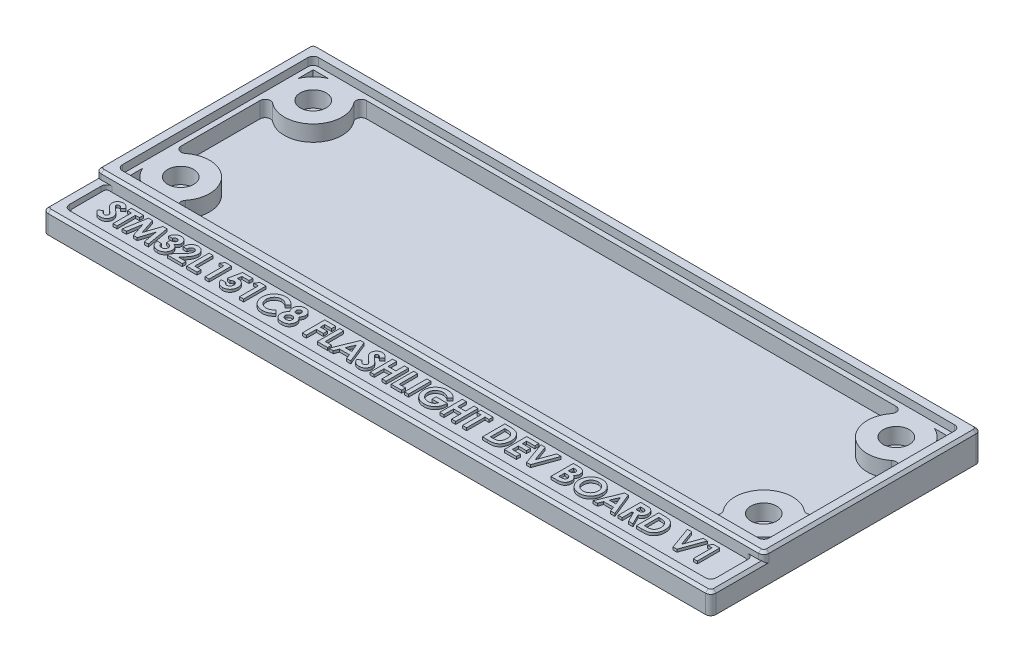
from build123d import *

# Parameters (mm, degrees)
SKETCH3_W           = 126
SKETCH3_H           = 41
SKETCH3_W_2         = 122
SKETCH3_H_2         = 37
SKETCH3_W_3         = 120
SKETCH3_H_3         = 35
SKETCH3_H_4         = 8
BOSS_EXTRUDE1_DEPTH = 1
BOSS_EXTRUDE2_START = 1
SKETCH3_3_W         = 126
SKETCH3_3_H         = 41
SKETCH3_3_W_2       = 122
SKETCH3_3_H_2       = 37
SKETCH3_3_W_3       = 120
SKETCH3_3_H_3       = 35
BOSS_EXTRUDE2_DEPTH = 3
BOSS_EXTRUDE3_START = 4
SKETCH3_4_W         = 126
SKETCH3_4_H         = 41
SKETCH3_4_W_2       = 122
SKETCH3_4_H_2       = 37
BOSS_EXTRUDE3_DEPTH = 1.5
SKETCH4_R           = 2.45
BOSS_EXTRUDE4_DEPTH = 3
FILLET1_R           = 1
CHAMFER1_SIZE       = 0.5
BOSS_EXTRUDE5_START = 0.5
BOSS_EXTRUDE5_DEPTH = 2
SKETCH6_W           = 0.75982906
SKETCH6_H           = 4.233333333
BOSS_EXTRUDE6_DEPTH = 0.5


with BuildPart() as part:
    # Sketch3 → Boss-Extrude1 (new body)
    # profile 1 of 5: a face of its own
    with BuildSketch(Plane(origin=(0, 0, 0), x_dir=(1, 0, 0), z_dir=(0, 1, 0))):
        Rectangle(SKETCH3_W, SKETCH3_H)
        Rectangle(SKETCH3_W_2, SKETCH3_H_2, mode=Mode.SUBTRACT)
    # profile 2 of 5: a face of its own
    with BuildSketch(Plane(origin=(0, 0, 0), x_dir=(1, 0, 0), z_dir=(0, 1, 0))):
        Rectangle(SKETCH3_W_2, SKETCH3_H_2)
        Rectangle(SKETCH3_W_3, SKETCH3_H_3, mode=Mode.SUBTRACT)
    # profile 3 of 5: a face of its own
    with BuildSketch(Plane(origin=(0, 0, 0), x_dir=(1, 0, 0), z_dir=(0, 1, 0))):
        Rectangle(SKETCH3_W_3, SKETCH3_H_3)
    # profile 4 of 5: a face of its own
    with BuildSketch(Plane(origin=(0, 0, 0), x_dir=(1, 0, 0), z_dir=(0, 1, 0))):
        Polygon((-61, -20.5), (-63, -20.5), (-63, -30.5), (63, -30.5), (63, -20.5), (61, -20.5), (61, -28.5), (-61, -28.5), align=None)
    # profile 5 of 5: a face of its own
    with BuildSketch(Plane(origin=(0, 0, 0), x_dir=(1, 0, 0), z_dir=(0, 1, 0))):
        with Locations((0, -24.5)):
            Rectangle(SKETCH3_W_2, SKETCH3_H_4)
    extrude(amount=BOSS_EXTRUDE1_DEPTH)

    # Sketch3<3> → Boss-Extrude2 (add)
    # profile 1 of 3: a face of its own
    with BuildSketch(Plane(origin=(0, 0, 0), x_dir=(1, 0, 0), z_dir=(0, 1, 0)).offset(BOSS_EXTRUDE2_START)):
        Polygon((-61, -20.5), (-63, -20.5), (-63, -30.5), (63, -30.5), (63, -20.5), (61, -20.5), (61, -28.5), (-61, -28.5), align=None)
    # profile 2 of 3: a face of its own
    with BuildSketch(Plane(origin=(0, 0, 0), x_dir=(1, 0, 0), z_dir=(0, 1, 0)).offset(BOSS_EXTRUDE2_START)):
        Rectangle(SKETCH3_3_W, SKETCH3_3_H)
        Rectangle(SKETCH3_3_W_2, SKETCH3_3_H_2, mode=Mode.SUBTRACT)
    # profile 3 of 3: a face of its own
    with BuildSketch(Plane(origin=(0, 0, 0), x_dir=(1, 0, 0), z_dir=(0, 1, 0)).offset(BOSS_EXTRUDE2_START)):
        Rectangle(SKETCH3_3_W_2, SKETCH3_3_H_2)
        Rectangle(SKETCH3_3_W_3, SKETCH3_3_H_3, mode=Mode.SUBTRACT)
    extrude(amount=BOSS_EXTRUDE2_DEPTH)

    # Sketch3<4> → Boss-Extrude3 (add)
    with BuildSketch(Plane(origin=(0, 0, 0), x_dir=(1, 0, 0), z_dir=(0, 1, 0)).offset(BOSS_EXTRUDE3_START)):
        Rectangle(SKETCH3_4_W, SKETCH3_4_H)
        Rectangle(SKETCH3_4_W_2, SKETCH3_4_H_2, mode=Mode.SUBTRACT)
    extrude(amount=BOSS_EXTRUDE3_DEPTH)

    # Sketch4 → Boss-Extrude4 (add)
    # profile 1 of 4: a face of its own
    with BuildSketch(Plane(origin=(0, 1, 0), x_dir=(1, 0, 0), z_dir=(0, 1, 0))):
        with BuildLine():
            ThreePointArc((-49.55, 12.5), (-50.443633004, 15.490321019), (-52.831475156, 17.5))
            Line((-52.831475156, 17.5), (-57.168524844, 17.5))
            ThreePointArc((-57.168524844, 17.5), (-58.853731957, 16.353731957), (-60, 14.668524844))
            Line((-60, 14.668524844), (-60, 10.331475156))
            ThreePointArc((-60, 10.331475156), (-53.89263827, 7.163685729), (-49.55, 12.5))
        make_face()
        with Locations(Location((-55, 12.5, 0), (0, 0, 90))):
            Circle(SKETCH4_R, mode=Mode.SUBTRACT)
    # profile 2 of 4: a face of its own
    with BuildSketch(Plane(origin=(0, 1, 0), x_dir=(1, 0, 0), z_dir=(0, 1, 0))):
        with BuildLine():
            ThreePointArc((60, 14.668524844), (58.853731957, 16.353731957), (57.168524844, 17.5))
            Line((57.168524844, 17.5), (52.831475156, 17.5))
            ThreePointArc((52.831475156, 17.5), (51.146268043, 8.646268043), (60, 10.331475156))
            Line((60, 10.331475156), (60, 14.668524844))
        make_face()
        with Locations(Location((55, 12.5, 0), (0, 0, 90))):
            Circle(SKETCH4_R, mode=Mode.SUBTRACT)
    # profile 3 of 4: a face of its own
    with BuildSketch(Plane(origin=(0, 1, 0), x_dir=(1, 0, 0), z_dir=(0, 1, 0))):
        with BuildLine():
            Line((60, -14.668524844), (60, -10.331475156))
            ThreePointArc((60, -10.331475156), (51.146268043, -8.646268043), (52.831475156, -17.5))
            Line((52.831475156, -17.5), (57.168524844, -17.5))
            ThreePointArc((57.168524844, -17.5), (58.853731957, -16.353731957), (60, -14.668524844))
        make_face()
        with Locations(Location((55, -12.5, 0), (0, 0, 90))):
            Circle(SKETCH4_R, mode=Mode.SUBTRACT)
    # profile 4 of 4: a face of its own
    with BuildSketch(Plane(origin=(0, 1, 0), x_dir=(1, 0, 0), z_dir=(0, 1, 0))):
        with BuildLine():
            Line((-57.168524844, -17.5), (-52.831475156, -17.5))
            ThreePointArc((-52.831475156, -17.5), (-50.443633004, -15.490321019), (-49.55, -12.5))
            ThreePointArc((-49.55, -12.5), (-53.89263827, -7.163685729), (-60, -10.331475156))
            Line((-60, -10.331475156), (-60, -14.668524844))
            ThreePointArc((-60, -14.668524844), (-58.853731957, -16.353731957), (-57.168524844, -17.5))
        make_face()
        with Locations(Location((-55, -12.5, 0), (0, 0, 90))):
            Circle(SKETCH4_R, mode=Mode.SUBTRACT)
    extrude(amount=BOSS_EXTRUDE4_DEPTH)

    # Fillet1
    fillet1_edges = [part.edges().sort_by_distance(p)[0] for p in [
        (63, 2.75, -20.5),
        (52.831475156, 2.5, -17.5),
        (60, 2.5, -10.331475156),
        (60, 2.5, 10.331475156),
        (52.831475156, 2.5, 17.5),
        (-60, 2.5, 10.331475156),
        (-52.831475156, 2.5, 17.5),
        (61, 2.5, 20.5),
        (-61, 2.5, 20.5),
        (-61, 2.5, 28.5),
        (61, 2.5, 28.5),
        (-63, 4.75, 20.5),
        (63, 4.75, 20.5),
        (-61, 4.75, -18.5),
        (-61, 4.75, 18.5),
        (61, 4.75, 18.5),
        (61, 4.75, -18.5),
        (-60, 2.5, -10.331475156),
        (-52.831475156, 2.5, -17.5),
        (63, 2, 30.5),
        (-63, 2, 30.5),
        (-63, 2.75, -20.5),
    ]]
    fillet(fillet1_edges, radius=FILLET1_R)

    # Chamfer1
    chamfer1_edges = [part.edges().sort_by_distance(p)[0] for p in [
        (0, 5.5, 20.5),
        (63, 5.5, 0),
        (0, 4, 30.5),
        (-63, 4, 24.5),
        (-62.707106781, 4, 30.207106781),
        (62.707106781, 4, 30.207106781),
        (-63, 5.5, 0),
        (0, 5.5, -20.5),
        (62.707106781, 5.5, -20.207106781),
        (-62.707106781, 5.5, -20.207106781),
        (-62.707106781, 5.5, 20.207106781),
        (62.707106781, 5.5, 20.207106781),
        (63, 4, 24.5),
    ]]
    chamfer(chamfer1_edges, length=CHAMFER1_SIZE)


with BuildPart() as body_2:
    # Sketch5 → Boss-Extrude5 (new body)
    with BuildSketch(Plane(origin=(0, 1, 0), x_dir=(1, 0, 0), z_dir=(0, 1, 0)).offset(BOSS_EXTRUDE5_START)):
        with BuildLine():
            Line((-60.5, -21.5), (-60.5, -27.5))
            ThreePointArc((-60.5, -27.5), (-60.353553391, -27.853553391), (-60, -28))
            Line((-60, -28), (60, -28))
            ThreePointArc((60, -28), (60.353553391, -27.853553391), (60.5, -27.5))
            Line((60.5, -27.5), (60.5, -21.5))
            ThreePointArc((60.5, -21.5), (60.353553391, -21.146446609), (60, -21))
            Line((60, -21), (-60, -21))
            ThreePointArc((-60, -21), (-60.353553391, -21.146446609), (-60.5, -21.5))
        make_face()
    extrude(amount=BOSS_EXTRUDE5_DEPTH)

    # Sketch6 → Boss-Extrude6 (add)
    # profile 1 of 31: a face of its own
    with BuildSketch(Plane(origin=(0, 3.5, 0), x_dir=(1, 0, 0), z_dir=(0, 1, 0))):
        with BuildLine():
            Line((-54.951923077, -22.846541576), (-55.520098825, -23.366379984))
            add(Edge.make_bspline(
                [(-55.520098825, -23.366379984), (-55.544437038, -23.332048405), (-55.591163012, -23.26613656), (-55.666900943, -23.177879047), (-55.742296878, -23.10258882), (-55.818049315, -23.040580407), (-55.894829695, -22.992230556), (-55.972504738, -22.957998327), (-56.050634083, -22.936236574), (-56.103124942, -22.933526713), (-56.128979701, -22.93219195)],
                knots=[0, 0, 0, 0, 1.299362458, 2.494594718, 3.587462134, 4.587049575, 5.512617175, 6.380583204, 7.202344345, 8, 8, 8, 8], degree=3))
            add(Edge.make_bspline(
                [(-56.128979701, -22.93219195), (-56.153096278, -22.933037717), (-56.199659053, -22.93467067), (-56.266037743, -22.950902103), (-56.324969689, -22.978915174), (-56.376397377, -23.015544619), (-56.417135693, -23.05967461), (-56.449662079, -23.105955623), (-56.467977168, -23.157039394), (-56.470387794, -23.192125789), (-56.471581197, -23.209495636)],
                knots=[0, 0, 0, 0, 1.185010067, 2.2879431, 3.333075148, 4.379039566, 5.372662701, 6.27520591, 7.14612461, 8, 8, 8, 8], degree=3))
            add(Edge.make_bspline(
                [(-56.471581197, -23.209495636), (-56.470833351, -23.227115964), (-56.469327295, -23.262600855), (-56.454780844, -23.314608383), (-56.432855188, -23.365425792), (-56.411904328, -23.396360767), (-56.401195246, -23.412173254)],
                knots=[0, 0, 0, 0, 0.967525499, 1.948461899, 2.951351359, 4, 4, 4, 4], degree=3))
            add(Edge.make_bspline(
                [(-56.401195246, -23.412173254), (-56.391459531, -23.424464134), (-56.369049203, -23.452756118), (-56.326317296, -23.49756621), (-56.272654996, -23.552462496), (-56.205997264, -23.615557252), (-56.129111245, -23.689119613), (-56.038433174, -23.770257814), (-55.936573161, -23.861484612), (-55.864173424, -23.925011651), (-55.82623531, -23.95830039)],
                knots=[0, 0, 0, 0, 0.473873513, 1.090794244, 1.870441696, 2.795289791, 3.865433203, 5.087734844, 6.473946851, 8, 8, 8, 8], degree=3))
            add(Edge.make_bspline(
                [(-55.82623531, -23.95830039), (-55.790624933, -23.989119376), (-55.723043835, -24.047607407), (-55.626889353, -24.130621776), (-55.542385578, -24.20530778), (-55.468301483, -24.270544542), (-55.405760109, -24.327016544), (-55.354498534, -24.374993722), (-55.313890683, -24.413542049), (-55.290807498, -24.436825261), (-55.280956197, -24.446761929)],
                knots=[0, 0, 0, 0, 1.543621617, 2.929473131, 4.163658386, 5.240097082, 6.164993805, 6.925417477, 7.541396219, 8, 8, 8, 8], degree=3))
            add(Edge.make_bspline(
                [(-55.280956197, -24.446761929), (-55.243582413, -24.487208366), (-55.171736877, -24.564960624), (-55.078363007, -24.68545217), (-55.001513292, -24.803076488), (-54.942060895, -24.92004687), (-54.897160053, -25.038050965), (-54.865504365, -25.159982818), (-54.846545563, -25.287116541), (-54.844440694, -25.373869787), (-54.843376068, -25.417748841)],
                knots=[0, 0, 0, 0, 1.206664779, 2.319633467, 3.337109185, 4.282041471, 5.190008762, 6.099243693, 7.03861361, 8, 8, 8, 8], degree=3))
            add(Edge.make_bspline(
                [(-54.843376068, -25.417748841), (-54.844133841, -25.460503599), (-54.84562062, -25.544390024), (-54.863830809, -25.667145312), (-54.889797469, -25.78462745), (-54.92994648, -25.895558067), (-54.978879858, -26.001758054), (-55.040224914, -26.101573154), (-55.112266271, -26.196013536), (-55.194836728, -26.283390964), (-55.286169457, -26.362679923), (-55.38413249, -26.433264827), (-55.489683758, -26.491541656), (-55.601921446, -26.539528468), (-55.720785479, -26.576488552), (-55.846134251, -26.603805499), (-55.978159493, -26.6202007), (-56.068440256, -26.621914624), (-56.114563301, -26.622790241)],
                knots=[0, 0, 0, 0, 1.043214005, 2.046824704, 3.02475056, 3.976699089, 4.921714032, 5.875962561, 6.831408892, 7.817874052, 8.806269674, 9.781291748, 10.760897367, 11.74438705, 12.757449933, 13.795994037, 14.874007457, 16, 16, 16, 16], degree=3))
            add(Edge.make_bspline(
                [(-56.114563301, -26.622790241), (-56.150769499, -26.622147919), (-56.222478534, -26.620875753), (-56.328166811, -26.610489576), (-56.43022079, -26.593727391), (-56.528525516, -26.569702173), (-56.623523869, -26.539258964), (-56.715219751, -26.50207375), (-56.802980155, -26.457570174), (-56.887469117, -26.406663407), (-56.968275917, -26.347553945), (-57.046422324, -26.281450262), (-57.121132116, -26.207335653), (-57.192764108, -26.125385396), (-57.260859977, -26.035367429), (-57.327648747, -25.938535417), (-57.390162124, -25.833092291), (-57.428779417, -25.759123084), (-57.448504274, -25.721341256)],
                knots=[0, 0, 0, 0, 1.016823716, 2.013894106, 2.979844003, 3.91962641, 4.853723003, 5.779685073, 6.695824784, 7.614987388, 8.547259901, 9.504950863, 10.487499108, 11.500346958, 12.559593716, 13.656357062, 14.802919212, 16, 16, 16, 16], degree=3))
            Line((-57.448504274, -25.721341256), (-56.780261752, -25.320226138))
            add(Edge.make_bspline(
                [(-56.780261752, -25.320226138), (-56.755588905, -25.36311345), (-56.708288948, -25.445332093), (-56.62813475, -25.555803259), (-56.546020865, -25.650403527), (-56.460048896, -25.72746083), (-56.371264228, -25.788005524), (-56.279238011, -25.831274963), (-56.183905589, -25.858058696), (-56.118969474, -25.861329609), (-56.086578526, -25.862961181)],
                knots=[0, 0, 0, 0, 1.283663364, 2.460892379, 3.537111102, 4.529833553, 5.449777664, 6.316464042, 7.160231139, 8, 8, 8, 8], degree=3))
            add(Edge.make_bspline(
                [(-56.086578526, -25.862961181), (-56.053632293, -25.861628751), (-55.989711804, -25.859043642), (-55.898473486, -25.83516577), (-55.814822741, -25.797675761), (-55.742515655, -25.744182687), (-55.681290573, -25.682443549), (-55.636102949, -25.613755936), (-55.607715778, -25.539437596), (-55.604714566, -25.487811188), (-55.603205128, -25.461846063)],
                knots=[0, 0, 0, 0, 1.13588714, 2.203786484, 3.234766741, 4.283437687, 5.291419208, 6.222934724, 7.106237994, 8, 8, 8, 8], degree=3))
            add(Edge.make_bspline(
                [(-55.603205128, -25.461846063), (-55.604599032, -25.43768974), (-55.607430615, -25.388618482), (-55.628287179, -25.315657412), (-55.66089235, -25.242729523), (-55.699466566, -25.182912096), (-55.738720661, -25.132828585), (-55.77625643, -25.089433489), (-55.821965068, -25.041489505), (-55.875730676, -24.988936323), (-55.936842872, -24.931311304), (-56.005353134, -24.86862009), (-56.082045978, -24.801414918), (-56.136252631, -24.755635418), (-56.164596688, -24.731697826)],
                knots=[0, 0, 0, 0, 0.916159276, 1.861089862, 2.860218735, 3.940849679, 4.552606315, 5.27541173, 6.11797699, 7.06649574, 8.129236253, 9.306560635, 10.591630461, 12, 12, 12, 12], degree=3))
            add(Edge.make_bspline(
                [(-56.164596688, -24.731697826), (-56.218479869, -24.686107488), (-56.321898002, -24.598605831), (-56.468040944, -24.469368637), (-56.599728821, -24.348584638), (-56.715824234, -24.234760679), (-56.817806419, -24.129998824), (-56.904984707, -24.033448159), (-56.976401406, -23.944363926), (-57.051552082, -23.838849613), (-57.122960249, -23.710273173), (-57.18467717, -23.555580811), (-57.224716503, -23.400908076), (-57.229202354, -23.297069322), (-57.231410256, -23.245960647)],
                knots=[0, 0, 0, 0, 1.345494975, 2.582412109, 3.71882943, 4.751509156, 5.681369928, 6.505683931, 7.230279997, 7.856715994, 8.973648664, 10.023341002, 11.027102913, 12, 12, 12, 12], degree=3))
            add(Edge.make_bspline(
                [(-57.231410256, -23.245960647), (-57.230491993, -23.209717118), (-57.228682914, -23.138313473), (-57.212545656, -23.033324816), (-57.18842791, -22.932019584), (-57.153402018, -22.834767384), (-57.107942639, -22.741690028), (-57.052733989, -22.652331864), (-56.986918783, -22.567515324), (-56.912749489, -22.487296635), (-56.831033916, -22.413985883), (-56.743710442, -22.349281798), (-56.651273325, -22.294631787), (-56.554288049, -22.249295634), (-56.452153636, -22.214593689), (-56.345622506, -22.189995221), (-56.23454186, -22.175364837), (-56.158987202, -22.173376006), (-56.120499466, -22.17236289)],
                knots=[0, 0, 0, 0, 1.010766082, 1.991317756, 2.957454644, 3.913069143, 4.869106762, 5.843196583, 6.838735724, 7.860187025, 8.887984031, 9.89767229, 10.887916223, 11.879572884, 12.879850636, 13.892031539, 14.926195476, 16, 16, 16, 16], degree=3))
            add(Edge.make_bspline(
                [(-56.120499466, -22.17236289), (-56.070621265, -22.174187541), (-55.971258584, -22.17782244), (-55.824347995, -22.206246159), (-55.680851874, -22.250945451), (-55.56522001, -22.304870229), (-55.473213894, -22.357107187), (-55.402699801, -22.405200398), (-55.330947916, -22.460293755), (-55.257379604, -22.522560874), (-55.183361879, -22.593174947), (-55.106790062, -22.670454952), (-55.028707539, -22.755068769), (-54.977966279, -22.815516487), (-54.951923077, -22.846541576)],
                knots=[0, 0, 0, 0, 1.282922637, 2.555718331, 3.837320111, 5.142675274, 5.830281639, 6.55870424, 7.337177975, 8.157850921, 9.037902056, 9.96903443, 10.957596896, 12, 12, 12, 12], degree=3))
        make_face()
    # profile 2 of 31: a face of its own
    with BuildSketch(Plane(origin=(0, 3.5, 0), x_dir=(1, 0, 0), z_dir=(0, 1, 0))):
        Polygon((-54.517735043, -22.280909899), (-52.238247863, -22.280909899), (-52.238247863, -23.040738959), (-52.998076923, -23.040738959), (-52.998076923, -26.514243232), (-53.757905983, -26.514243232), (-53.757905983, -23.040738959), (-54.517735043, -23.040738959), align=None)
    # profile 3 of 31: a face of its own
    with BuildSketch(Plane(origin=(0, 3.5, 0), x_dir=(1, 0, 0), z_dir=(0, 1, 0))):
        Polygon((-51.306270032, -22.280909899), (-50.51930422, -22.280909899), (-49.551709402, -25.233727741), (-48.579026442, -22.280909899), (-47.797996795, -22.280909899), (-47.082264957, -26.514243232), (-47.851422276, -26.514243232), (-48.303418803, -23.840425123), (-49.183667201, -26.514243232), (-49.92399172, -26.514243232), (-50.8, -23.840425123), (-51.251148504, -26.514243232), (-52.021153846, -26.514243232), align=None)
    # profile 4 of 31: a face of its own
    with BuildSketch(Plane(origin=(0, 3.5, 0), x_dir=(1, 0, 0), z_dir=(0, 1, 0))):
        with BuildLine():
            Line((-45.72542735, -23.31210648), (-46.48525641, -23.31210648))
            add(Edge.make_bspline(
                [(-46.48525641, -23.31210648), (-46.479891728, -23.274125336), (-46.469374624, -23.199665819), (-46.444208601, -23.091866987), (-46.414107321, -22.989612418), (-46.376527412, -22.89322593), (-46.332452292, -22.802535828), (-46.282330156, -22.717230907), (-46.225619165, -22.637677312), (-46.182149589, -22.589753911), (-46.160463408, -22.565845796)],
                knots=[0, 0, 0, 0, 1.111473889, 2.178970933, 3.205615836, 4.199322666, 5.174200091, 6.12565194, 7.064921805, 8, 8, 8, 8], degree=3))
            add(Edge.make_bspline(
                [(-46.160463408, -22.565845796), (-46.129183965, -22.534300772), (-46.06753547, -22.472128844), (-45.964513604, -22.392493472), (-45.856527664, -22.323574473), (-45.741411942, -22.268934992), (-45.620957727, -22.224710662), (-45.494207126, -22.19500508), (-45.361678086, -22.175295164), (-45.271243688, -22.173353668), (-45.225093483, -22.17236289)],
                knots=[0, 0, 0, 0, 1.01925491, 2.00884431, 2.983262333, 3.955970413, 4.92937149, 5.924503185, 6.940838805, 8, 8, 8, 8], degree=3))
            add(Edge.make_bspline(
                [(-45.225093483, -22.17236289), (-45.184063576, -22.173331526), (-45.103407046, -22.175235669), (-44.984862242, -22.190521092), (-44.871839692, -22.217330023), (-44.763144714, -22.252382099), (-44.660375859, -22.300076306), (-44.561264916, -22.355439129), (-44.46858105, -22.423343932), (-44.382107398, -22.500069526), (-44.302664856, -22.583055766), (-44.233867267, -22.671761233), (-44.174720745, -22.763816397), (-44.125991834, -22.859986065), (-44.088525923, -22.960432966), (-44.06252347, -23.064576832), (-44.045504233, -23.172187862), (-44.043808672, -23.24532963), (-44.042948718, -23.282425657)],
                knots=[0, 0, 0, 0, 1.091422571, 2.145516843, 3.172569842, 4.178562979, 5.178154469, 6.181868002, 7.194278174, 8.227918432, 9.254613415, 10.245994977, 11.209837596, 12.161663635, 13.10878368, 14.055455738, 15.013766427, 16, 16, 16, 16], degree=3))
            add(Edge.make_bspline(
                [(-44.042948718, -23.282425657), (-44.044713395, -23.328365998), (-44.048187502, -23.418808405), (-44.076695066, -23.551177587), (-44.121317155, -23.677746147), (-44.185778102, -23.796743201), (-44.266370704, -23.907844905), (-44.365255128, -24.007336796), (-44.479614888, -24.096778773), (-44.565466283, -24.144844902), (-44.609428419, -24.169458243)],
                knots=[0, 0, 0, 0, 0.992805628, 1.954529043, 2.915727527, 3.886831945, 4.871318353, 5.87440735, 6.911542536, 8, 8, 8, 8], degree=3))
            add(Edge.make_bspline(
                [(-44.609428419, -24.169458243), (-44.579253483, -24.17936531), (-44.519961089, -24.198832251), (-44.435684079, -24.237172172), (-44.355546273, -24.279071351), (-44.280927615, -24.327747152), (-44.211085931, -24.381231341), (-44.146446986, -24.439981121), (-44.086624577, -24.503868389), (-44.03259528, -24.573244501), (-43.984642167, -24.646999922), (-43.941616393, -24.723430945), (-43.906203782, -24.80369666), (-43.876204892, -24.886880379), (-43.853365446, -24.973729713), (-43.837284434, -25.063908128), (-43.827989215, -25.157209921), (-43.826571535, -25.220421829), (-43.825854701, -25.252384258)],
                knots=[0, 0, 0, 0, 1.059543567, 2.081955587, 3.086750234, 4.076226789, 5.052108497, 6.020845489, 6.989030705, 7.970690546, 8.952259656, 9.923888338, 10.895517021, 11.877585046, 12.873342345, 13.889638361, 14.932918083, 16, 16, 16, 16], degree=3))
            add(Edge.make_bspline(
                [(-43.825854701, -25.252384258), (-43.827307821, -25.299356051), (-43.830173077, -25.391974862), (-43.848389038, -25.528392892), (-43.882303874, -25.658455363), (-43.92692072, -25.78365884), (-43.986434749, -25.902386993), (-44.056472757, -26.01736447), (-44.14256354, -26.124603884), (-44.238238664, -26.226940368), (-44.344491466, -26.319980116), (-44.45968679, -26.400641391), (-44.581291588, -26.469863117), (-44.71007522, -26.526059286), (-44.845992943, -26.569336763), (-44.988741809, -26.600619719), (-45.138921609, -26.619759148), (-45.241431073, -26.621765555), (-45.293783387, -26.622790241)],
                knots=[0, 0, 0, 0, 1.005138573, 1.981928558, 2.936866704, 3.876260664, 4.820238198, 5.773547, 6.751179199, 7.756627054, 8.768222608, 9.766606018, 10.760583154, 11.757261445, 12.767156078, 13.807575856, 14.880313354, 16, 16, 16, 16], degree=3))
            add(Edge.make_bspline(
                [(-45.293783387, -26.622790241), (-45.343307832, -26.621709883), (-45.44014633, -26.619597385), (-45.581792901, -26.601312649), (-45.716414559, -26.571817887), (-45.844354861, -26.530242573), (-45.965118816, -26.476326497), (-46.079801558, -26.412124547), (-46.186114618, -26.333933705), (-46.285242534, -26.245283652), (-46.374986349, -26.145823327), (-46.455196185, -26.037856679), (-46.524103402, -25.920973153), (-46.581990589, -25.795672126), (-46.628405199, -25.661733782), (-46.665016907, -25.51943049), (-46.690590784, -25.368484236), (-46.698379362, -25.264630001), (-46.702350427, -25.21167913)],
                knots=[0, 0, 0, 0, 1.066544725, 2.085487077, 3.070979577, 4.031932826, 4.977951092, 5.916076795, 6.857635327, 7.814973522, 8.776389752, 9.738577119, 10.707772778, 11.69409279, 12.707140348, 13.757286496, 14.856535458, 16, 16, 16, 16], degree=3))
            Line((-46.702350427, -25.21167913), (-45.942521368, -25.21167913))
            add(Edge.make_bspline(
                [(-45.942521368, -25.21167913), (-45.93770641, -25.238303523), (-45.928328018, -25.290161511), (-45.910036038, -25.36524035), (-45.886199037, -25.434542755), (-45.858637533, -25.498684684), (-45.82886696, -25.5585083), (-45.792896988, -25.611804167), (-45.753363308, -25.660019487), (-45.696315919, -25.717338391), (-45.614762748, -25.776231172), (-45.504638949, -25.8274118), (-45.382136652, -25.857409936), (-45.296495328, -25.861069616), (-45.252230235, -25.862961181)],
                knots=[0, 0, 0, 0, 0.928156231, 1.807827665, 2.648129825, 3.438902246, 4.202261636, 4.936546065, 5.639352463, 6.338805438, 7.70633318, 9.064371875, 10.482673459, 12, 12, 12, 12], degree=3))
            add(Edge.make_bspline(
                [(-45.252230235, -25.862961181), (-45.228741612, -25.86255839), (-45.182732654, -25.861769413), (-45.115152346, -25.853024657), (-45.050772587, -25.838622037), (-44.989473466, -25.819049411), (-44.93086475, -25.794513901), (-44.876066217, -25.762876828), (-44.823960936, -25.726094215), (-44.775115338, -25.684740792), (-44.729980999, -25.639680366), (-44.692426575, -25.589783598), (-44.658104549, -25.539079565), (-44.632719731, -25.484251028), (-44.610477161, -25.428248349), (-44.596863573, -25.369038807), (-44.586584335, -25.307864458), (-44.585986947, -25.265999419), (-44.585683761, -25.244752046)],
                knots=[0, 0, 0, 0, 1.110435564, 2.175094844, 3.216326037, 4.226890168, 5.215276772, 6.21526065, 7.213097102, 8.228249917, 9.239874822, 10.221364777, 11.178138315, 12.128914389, 13.072518965, 14.022636769, 14.996447288, 16, 16, 16, 16], degree=3))
            add(Edge.make_bspline(
                [(-44.585683761, -25.244752046), (-44.586488665, -25.221514424), (-44.588091044, -25.175253644), (-44.601182654, -25.107745761), (-44.621857072, -25.042808619), (-44.650576364, -24.98072979), (-44.688927778, -24.921738083), (-44.734182019, -24.864649947), (-44.789904373, -24.812436718), (-44.851039257, -24.760825522), (-44.921931705, -24.715836126), (-44.999129157, -24.674317523), (-45.08466048, -24.641281534), (-45.17643778, -24.611774276), (-45.276197108, -24.590222633), (-45.383318997, -24.57457404), (-45.497630643, -24.562926087), (-45.576427146, -24.561254997), (-45.616880342, -24.560397078)],
                knots=[0, 0, 0, 0, 0.809814727, 1.612155564, 2.388397, 3.182215007, 3.988903953, 4.837162975, 5.715530372, 6.646997145, 7.623086902, 8.637258368, 9.698941581, 10.815059213, 11.996518529, 13.252603015, 14.589518788, 16, 16, 16, 16], degree=3))
            Line((-45.616880342, -24.560397078), (-45.616880342, -23.854841523))
            add(Edge.make_bspline(
                [(-45.616880342, -23.854841523), (-45.566513708, -23.850552139), (-45.472287709, -23.842527552), (-45.341496971, -23.823761775), (-45.231388029, -23.798678224), (-45.139314413, -23.768416278), (-45.062862382, -23.729552056), (-44.99607431, -23.68664767), (-44.938553263, -23.636820496), (-44.889940262, -23.581556374), (-44.851051374, -23.52220789), (-44.823528084, -23.459697493), (-44.805353142, -23.395959334), (-44.803631067, -23.352364355), (-44.802777778, -23.330762997)],
                knots=[0, 0, 0, 0, 1.70044513, 3.18119609, 4.440695891, 5.496282586, 6.431922213, 7.318171381, 8.16090191, 8.983045123, 9.787564368, 10.536848927, 11.275007137, 12, 12, 12, 12], degree=3))
            add(Edge.make_bspline(
                [(-44.802777778, -23.330762997), (-44.804249947, -23.303202011), (-44.807123309, -23.2494088), (-44.829439394, -23.172419384), (-44.868177591, -23.1037897), (-44.92011871, -23.043664165), (-44.98341077, -22.993442813), (-45.05760016, -22.956982967), (-45.141076965, -22.935561179), (-45.199807395, -22.933340462), (-45.230181624, -22.93219195)],
                knots=[0, 0, 0, 0, 1.009664648, 1.970651636, 2.907870547, 3.878035693, 4.867062054, 5.849714035, 6.887914197, 8, 8, 8, 8], degree=3))
            add(Edge.make_bspline(
                [(-45.230181624, -22.93219195), (-45.257712447, -22.933547073), (-45.312342033, -22.936236052), (-45.392226838, -22.956305879), (-45.468090788, -22.990090935), (-45.538362955, -23.036678536), (-45.602028946, -23.09262827), (-45.654280355, -23.158889117), (-45.697740601, -23.231491274), (-45.716162254, -23.2851294), (-45.72542735, -23.31210648)],
                knots=[0, 0, 0, 0, 0.98818071, 1.960853194, 2.938124878, 3.957524365, 4.978590984, 5.968022688, 6.978025184, 8, 8, 8, 8], degree=3))
        make_face()
    # profile 5 of 31: a face of its own
    with BuildSketch(Plane(origin=(0, 3.5, 0), x_dir=(1, 0, 0), z_dir=(0, 1, 0))):
        with BuildLine():
            Line((-42.631837607, -23.69202101), (-43.391666667, -23.69202101))
            add(Edge.make_bspline(
                [(-43.391666667, -23.69202101), (-43.388385081, -23.634543961), (-43.381973061, -23.52223726), (-43.356467665, -23.359108179), (-43.322291308, -23.204969136), (-43.276678424, -23.060359326), (-43.219362851, -22.925331296), (-43.151819465, -22.799424727), (-43.072322688, -22.683302521), (-42.982564472, -22.577524684), (-42.884068664, -22.482630411), (-42.778880134, -22.398491186), (-42.665389882, -22.329061616), (-42.545671468, -22.271927507), (-42.419745276, -22.226280009), (-42.286419849, -22.195760963), (-42.146849589, -22.175093166), (-42.051302444, -22.173284651), (-42.002604167, -22.17236289)],
                knots=[0, 0, 0, 0, 1.199038563, 2.342849363, 3.436047546, 4.486744587, 5.497670872, 6.488682221, 7.459191391, 8.424610317, 9.374430501, 10.305433194, 11.225809216, 12.140057399, 13.06607119, 14.010487599, 14.985989317, 16, 16, 16, 16], degree=3))
            add(Edge.make_bspline(
                [(-42.002604167, -22.17236289), (-41.942827723, -22.174228073), (-41.826130095, -22.177869347), (-41.656559186, -22.208930619), (-41.498198498, -22.260885397), (-41.351163143, -22.333479924), (-41.216704859, -22.42570366), (-41.094845944, -22.535665372), (-40.989271605, -22.665672114), (-40.89931247, -22.810314518), (-40.82456718, -22.963470467), (-40.772188795, -23.12184007), (-40.737761046, -23.281220839), (-40.734089113, -23.388539781), (-40.732264957, -23.441854076)],
                knots=[0, 0, 0, 0, 1.075374347, 2.099382735, 3.09057751, 4.06680945, 5.040638231, 6.016817125, 7.011024321, 8.044445721, 9.0776792, 10.070479129, 11.0414456, 12, 12, 12, 12], degree=3))
            add(Edge.make_bspline(
                [(-40.732264957, -23.441854076), (-40.732975187, -23.47410233), (-40.734404705, -23.539010099), (-40.744344331, -23.637231483), (-40.759255733, -23.737281447), (-40.781738494, -23.839074207), (-40.809776341, -23.942638296), (-40.843790301, -24.048283647), (-40.884569362, -24.155411289), (-40.931433005, -24.265226925), (-40.98734145, -24.378087084), (-41.052439062, -24.495683583), (-41.12845368, -24.617912105), (-41.214467144, -24.745462793), (-41.3108972, -24.878134478), (-41.418214587, -25.015527513), (-41.535183262, -25.158126026), (-41.618199221, -25.25344513), (-41.660850694, -25.302417645)],
                knots=[0, 0, 0, 0, 0.728284026, 1.46585585, 2.227944881, 3.01186502, 3.81876927, 4.650621989, 5.517437689, 6.406905708, 7.346299482, 8.360816762, 9.441613733, 10.596154504, 11.834900912, 13.145207542, 14.533280747, 16, 16, 16, 16], degree=3))
            Line((-41.660850694, -25.302417645), (-42.10267094, -25.808687677))
            Line((-42.10267094, -25.808687677), (-40.677991453, -25.808687677))
            Line((-40.677991453, -25.808687677), (-40.677991453, -26.514243232))
            Line((-40.677991453, -26.514243232), (-43.500213675, -26.514243232))
            Line((-43.500213675, -26.514243232), (-43.500213675, -26.129240561))
            Line((-43.500213675, -26.129240561), (-42.246834936, -24.795299589))
            add(Edge.make_bspline(
                [(-42.246834936, -24.795299589), (-42.2105464, -24.756388117), (-42.140266269, -24.681028134), (-42.040264884, -24.570353982), (-41.949772465, -24.465326854), (-41.870665445, -24.364828422), (-41.798792389, -24.272118447), (-41.737358112, -24.184402534), (-41.685800537, -24.102473667), (-41.629827478, -24.003681761), (-41.576671471, -23.885854835), (-41.527897617, -23.750113384), (-41.498166578, -23.620375818), (-41.494062754, -23.535836032), (-41.492094017, -23.495279557)],
                knots=[0, 0, 0, 0, 1.246127091, 2.413378631, 3.493388633, 4.492180848, 5.408488754, 6.240484944, 6.999099869, 7.674939598, 8.898438119, 10.020720584, 11.050475521, 12, 12, 12, 12], degree=3))
            add(Edge.make_bspline(
                [(-41.492094017, -23.495279557), (-41.493565994, -23.456044296), (-41.496418186, -23.380019688), (-41.527761464, -23.271875087), (-41.576319556, -23.173961191), (-41.644744766, -23.089203777), (-41.727629126, -23.01955299), (-41.82340979, -22.967748691), (-41.931305863, -22.937857848), (-42.006943066, -22.934116582), (-42.045853365, -22.93219195)],
                knots=[0, 0, 0, 0, 1.062038974, 2.057870785, 3.028805853, 4.01125022, 4.991535629, 5.949134679, 6.94496649, 8, 8, 8, 8], degree=3))
            add(Edge.make_bspline(
                [(-42.045853365, -22.93219195), (-42.065954922, -22.932902932), (-42.105528064, -22.934302615), (-42.163697489, -22.943619921), (-42.219049876, -22.960040702), (-42.272201328, -22.982042236), (-42.322584599, -23.011205428), (-42.370072606, -23.047153709), (-42.415165695, -23.08897355), (-42.457657052, -23.136534187), (-42.496329733, -23.189611872), (-42.530678667, -23.247721849), (-42.559079517, -23.310828047), (-42.584084658, -23.378097368), (-42.603369819, -23.450252339), (-42.617411809, -23.526861121), (-42.628086996, -23.607799082), (-42.63056466, -23.663436319), (-42.631837607, -23.69202101)],
                knots=[0, 0, 0, 0, 0.903469896, 1.778625579, 2.63899355, 3.493148037, 4.358286772, 5.247621495, 6.164656832, 7.118446693, 8.109501108, 9.111810964, 10.146451449, 11.215617525, 12.33435995, 13.498009769, 14.714554818, 16, 16, 16, 16], degree=3))
        make_face()
    # profile 6 of 31: a face of its own
    with BuildSketch(Plane(origin=(0, 3.5, 0), x_dir=(1, 0, 0), z_dir=(0, 1, 0))):
        Polygon((-39.863888889, -22.280909899), (-39.104059829, -22.280909899), (-39.104059829, -25.754414172), (-37.910042735, -25.754414172), (-37.910042735, -26.514243232), (-39.863888889, -26.514243232), align=None)
    # profile 7 of 31: a face of its own
    with BuildSketch(Plane(origin=(0, 3.5, 0), x_dir=(1, 0, 0), z_dir=(0, 1, 0))):
        Polygon((-36.805068109, -22.280909899), (-35.630555556, -22.280909899), (-35.630555556, -26.514243232), (-36.390384615, -26.514243232), (-36.390384615, -22.986465454), (-37.258760684, -22.986465454), align=None)
    # profile 8 of 31: a face of its own
    with BuildSketch(Plane(origin=(0, 3.5, 0), x_dir=(1, 0, 0), z_dir=(0, 1, 0))):
        with BuildLine():
            Line((-33.541873665, -22.280909899), (-31.614316239, -22.280909899))
            Line((-31.614316239, -22.280909899), (-31.614316239, -22.986465454))
            Line((-31.614316239, -22.986465454), (-32.939776976, -22.986465454))
            Line((-32.939776976, -22.986465454), (-33.10514156, -23.786999643))
            add(Edge.make_bspline(
                [(-33.10514156, -23.786999643), (-33.082608268, -23.780723836), (-33.038167987, -23.768346657), (-32.971218649, -23.755933912), (-32.906335411, -23.747888366), (-32.863759425, -23.746815197), (-32.843102297, -23.746294514)],
                knots=[0, 0, 0, 0, 1.05461699, 2.079921384, 3.068411212, 4, 4, 4, 4], degree=3))
            add(Edge.make_bspline(
                [(-32.843102297, -23.746294514), (-32.79808825, -23.747325985), (-32.709355648, -23.749359241), (-32.579551111, -23.768661474), (-32.455255598, -23.799061906), (-32.336849468, -23.842419195), (-32.224448388, -23.898849825), (-32.117916105, -23.96711507), (-32.017121869, -24.047334826), (-31.92385621, -24.13955932), (-31.838159826, -24.240823902), (-31.763651709, -24.350352262), (-31.700017126, -24.466582633), (-31.64940438, -24.590237499), (-31.609456485, -24.720540226), (-31.580589244, -24.857574316), (-31.563518603, -25.001502173), (-31.561216732, -25.099693859), (-31.560042735, -25.149773414)],
                knots=[0, 0, 0, 0, 1.01440847, 1.999622559, 2.951875003, 3.895578053, 4.836219714, 5.782137149, 6.743708247, 7.735272588, 8.734977101, 9.730283169, 10.717124674, 11.717316708, 12.737475749, 13.78628267, 14.87096371, 16, 16, 16, 16], degree=3))
            add(Edge.make_bspline(
                [(-31.560042735, -25.149773414), (-31.561477378, -25.200421487), (-31.564308347, -25.300364941), (-31.582777826, -25.447317171), (-31.615376788, -25.588064232), (-31.660154725, -25.722982901), (-31.71914679, -25.851081558), (-31.790092822, -25.973687209), (-31.874192327, -26.089889793), (-31.970620001, -26.198498091), (-32.075449532, -26.29776816), (-32.187068236, -26.38509623), (-32.304691959, -26.458582094), (-32.428323538, -26.517971095), (-32.557253661, -26.564958616), (-32.691521458, -26.599163288), (-32.831779454, -26.618777767), (-32.92699641, -26.621438052), (-32.975393964, -26.622790241)],
                knots=[0, 0, 0, 0, 1.06808661, 2.107647099, 3.116961351, 4.110378221, 5.100014249, 6.085620622, 7.093190682, 8.119403071, 9.144090782, 10.133780668, 11.103064255, 12.062861538, 13.020824475, 13.992378307, 14.979551724, 16, 16, 16, 16], degree=3))
            add(Edge.make_bspline(
                [(-32.975393964, -26.622790241), (-33.018674455, -26.621684066), (-33.104032642, -26.619502459), (-33.229761503, -26.606093149), (-33.350978088, -26.582385363), (-33.467038868, -26.548074058), (-33.579164996, -26.505844675), (-33.686060263, -26.45302885), (-33.788312077, -26.390632269), (-33.88563008, -26.319793671), (-33.976432995, -26.239996737), (-34.059308273, -26.152645244), (-34.134757653, -26.058840216), (-34.201166637, -25.957424382), (-34.258327051, -25.84854758), (-34.309018073, -25.733492947), (-34.350509182, -25.611058946), (-34.371564725, -25.526180894), (-34.382264957, -25.483046651)],
                knots=[0, 0, 0, 0, 1.054957082, 2.080596141, 3.077793124, 4.061112343, 5.027190972, 5.994718051, 6.962465889, 7.943658696, 8.924948258, 9.904494768, 10.875059, 11.855380583, 12.854004648, 13.869083016, 14.917087635, 16, 16, 16, 16], degree=3))
            Line((-34.382264957, -25.483046651), (-33.513888889, -25.483046651))
            add(Edge.make_bspline(
                [(-33.513888889, -25.483046651), (-33.498014953, -25.512936925), (-33.467165771, -25.571025262), (-33.408483807, -25.648146257), (-33.342793073, -25.713911728), (-33.270686136, -25.768964219), (-33.191695789, -25.810208608), (-33.109040737, -25.841486445), (-33.021682621, -25.859560748), (-32.962187887, -25.861820215), (-32.932144765, -25.862961181)],
                knots=[0, 0, 0, 0, 1.104910296, 2.147267069, 3.153527244, 4.136738762, 5.099945312, 6.05603338, 7.018353, 8, 8, 8, 8], degree=3))
            add(Edge.make_bspline(
                [(-32.932144765, -25.862961181), (-32.911205112, -25.862173334), (-32.870005991, -25.860623233), (-32.809305602, -25.852422806), (-32.751364413, -25.836891383), (-32.695751647, -25.815383973), (-32.642317913, -25.788561803), (-32.591829201, -25.754700562), (-32.543407101, -25.715725017), (-32.497788791, -25.671000448), (-32.456471752, -25.621142957), (-32.420241227, -25.567567683), (-32.387846142, -25.511465082), (-32.363850608, -25.450612788), (-32.344200294, -25.386827873), (-32.329729008, -25.319629187), (-32.321080783, -25.248938248), (-32.320280188, -25.200679525), (-32.319871795, -25.176062143)],
                knots=[0, 0, 0, 0, 0.978869489, 1.925942215, 2.855067702, 3.774946051, 4.70828698, 5.642468714, 6.60995405, 7.609372294, 8.622401667, 9.629904756, 10.629323, 11.642352373, 12.678539694, 13.745912462, 14.850161547, 16, 16, 16, 16], degree=3))
            add(Edge.make_bspline(
                [(-32.319871795, -25.176062143), (-32.320345782, -25.152016185), (-32.321268411, -25.105210146), (-32.328900577, -25.036482115), (-32.342554376, -24.971271651), (-32.361157794, -24.909079291), (-32.384972389, -24.850282698), (-32.414075417, -24.794531886), (-32.448591208, -24.742108654), (-32.48870507, -24.694080288), (-32.53148208, -24.650027306), (-32.577438335, -24.611498918), (-32.626159792, -24.579523031), (-32.676132492, -24.551607152), (-32.729351166, -24.531290583), (-32.78461914, -24.517299312), (-32.841878292, -24.50703308), (-32.880933518, -24.506429901), (-32.900767895, -24.506123574)],
                knots=[0, 0, 0, 0, 1.166249705, 2.270133367, 3.348514167, 4.393962215, 5.415026464, 6.420877785, 7.440098956, 8.453121383, 9.451844239, 10.415694839, 11.355045125, 12.27538808, 13.187007209, 14.108269027, 15.039275622, 16, 16, 16, 16], degree=3))
            add(Edge.make_bspline(
                [(-32.900767895, -24.506123574), (-32.922312639, -24.506941078), (-32.965492929, -24.50857953), (-33.029648031, -24.521911177), (-33.093029601, -24.543486782), (-33.155990106, -24.57325375), (-33.217904553, -24.612209318), (-33.280406895, -24.657899734), (-33.341405045, -24.713644838), (-33.380189365, -24.755163919), (-33.400253739, -24.776643072)],
                knots=[0, 0, 0, 0, 0.88288272, 1.769486374, 2.674910571, 3.623812639, 4.617874466, 5.670434592, 6.794841017, 8, 8, 8, 8], degree=3))
            Line((-33.400253739, -24.776643072), (-34.039663462, -24.629935006))
            Line((-34.039663462, -24.629935006), (-33.541873665, -22.280909899))
        make_face()
    # profile 9 of 31: a face of its own
    with BuildSketch(Plane(origin=(0, 3.5, 0), x_dir=(1, 0, 0), z_dir=(0, 1, 0))):
        Polygon((-30.292247596, -22.280909899), (-29.117735043, -22.280909899), (-29.117735043, -26.514243232), (-29.877564103, -26.514243232), (-29.877564103, -22.986465454), (-30.745940171, -22.986465454), align=None)
    # profile 10 of 31: a face of its own
    with BuildSketch(Plane(origin=(0, 3.5, 0), x_dir=(1, 0, 0), z_dir=(0, 1, 0))):
        with BuildLine():
            Line((-23.690384615, -23.015298254), (-24.247536058, -23.547857014))
            add(Edge.make_bspline(
                [(-24.247536058, -23.547857014), (-24.294798182, -23.498987899), (-24.387115918, -23.403531205), (-24.535874531, -23.277154956), (-24.690578073, -23.171837451), (-24.848217094, -23.083139719), (-25.011627064, -23.016033563), (-25.178918519, -22.967132177), (-25.351159663, -22.93731885), (-25.467725844, -22.933907678), (-25.526355502, -22.93219195)],
                knots=[0, 0, 0, 0, 1.115251505, 2.178435587, 3.19620269, 4.182487026, 5.141301733, 6.088180966, 7.038406374, 8, 8, 8, 8], degree=3))
            add(Edge.make_bspline(
                [(-25.526355502, -22.93219195), (-25.575318392, -22.933547435), (-25.67194126, -22.936222336), (-25.81380895, -22.955831995), (-25.949512728, -22.989179073), (-26.079517129, -23.035137524), (-26.203439608, -23.094605321), (-26.321539987, -23.167536437), (-26.433527091, -23.253272199), (-26.537921638, -23.351369009), (-26.633418101, -23.458547144), (-26.717795306, -23.572905959), (-26.78847475, -23.694183464), (-26.84648022, -23.821151449), (-26.891664239, -23.954397585), (-26.923931306, -24.093832166), (-26.942593714, -24.239621247), (-26.945379204, -24.338727578), (-26.946794872, -24.389096331)],
                knots=[0, 0, 0, 0, 1.035432265, 2.043311493, 3.022114605, 3.98653278, 4.95457646, 5.923598177, 6.917315552, 7.932509744, 8.948865224, 9.949768934, 10.933144597, 11.912367597, 12.897413939, 13.903909035, 14.934704909, 16, 16, 16, 16], degree=3))
            add(Edge.make_bspline(
                [(-26.946794872, -24.389096331), (-26.946386892, -24.424448645), (-26.945582757, -24.494128785), (-26.936780071, -24.597205049), (-26.922605671, -24.697213394), (-26.902091802, -24.794002334), (-26.876439007, -24.887655746), (-26.846342437, -24.978981574), (-26.808586734, -25.066717901), (-26.766677333, -25.151883726), (-26.717937183, -25.232155195), (-26.66538631, -25.308700702), (-26.608403468, -25.381145029), (-26.546619576, -25.449192022), (-26.479165102, -25.511778258), (-26.407783496, -25.570785781), (-26.331270647, -25.624737431), (-26.251215922, -25.674987185), (-26.166927749, -25.718639575), (-26.080693062, -25.758180206), (-25.991204369, -25.790293077), (-25.899551249, -25.816178981), (-25.806061237, -25.838191076), (-25.709819915, -25.8517446), (-25.611661573, -25.862008525), (-25.545323011, -25.862642262), (-25.511939103, -25.862961181)],
                knots=[0, 0, 0, 0, 1.103660481, 2.175337485, 3.227646561, 4.255952547, 5.262355991, 6.258840057, 7.255597736, 8.242457506, 9.22035537, 10.185017736, 11.140346927, 12.096287581, 13.051739095, 14.01125915, 14.986044842, 15.97314143, 16.960198552, 17.947847494, 18.933482797, 19.925264591, 20.920966487, 21.929612487, 22.958107872, 24, 24, 24, 24], degree=3))
            add(Edge.make_bspline(
                [(-25.511939103, -25.862961181), (-25.455314257, -25.86132329), (-25.344061161, -25.85810526), (-25.180781246, -25.832940722), (-25.025191753, -25.79154648), (-24.900876493, -25.742662286), (-24.80347877, -25.69438851), (-24.729331323, -25.649737644), (-24.652657085, -25.599790748), (-24.574729547, -25.542662772), (-24.494672181, -25.479039275), (-24.413898183, -25.407526783), (-24.330339725, -25.330480101), (-24.275601407, -25.27549037), (-24.247536058, -25.247296117)],
                knots=[0, 0, 0, 0, 1.404581149, 2.759636711, 4.088442092, 5.392261763, 6.066678138, 6.783632037, 7.538459478, 8.336747902, 9.180226004, 10.074962426, 11.012997595, 12, 12, 12, 12], degree=3))
            Line((-24.247536058, -25.247296117), (-23.707345085, -25.814623841))
            add(Edge.make_bspline(
                [(-23.707345085, -25.814623841), (-23.745317603, -25.851285115), (-23.819431837, -25.922840081), (-23.931231102, -26.024441456), (-24.042889662, -26.115741586), (-24.151710081, -26.200054265), (-24.259474949, -26.274923261), (-24.366172839, -26.340423346), (-24.470595884, -26.398211112), (-24.574912462, -26.447311996), (-24.679771685, -26.489003747), (-24.787659502, -26.524897607), (-24.898905737, -26.555262522), (-25.014189832, -26.579763021), (-25.132436486, -26.599409113), (-25.254752331, -26.612670111), (-25.380361824, -26.621585039), (-25.46556469, -26.62238612), (-25.508547009, -26.622790241)],
                knots=[0, 0, 0, 0, 1.244526981, 2.429050516, 3.560637417, 4.644440555, 5.67424972, 6.652764056, 7.595344123, 8.486817594, 9.369275933, 10.254498637, 11.166417451, 12.086725134, 13.032340136, 13.991389299, 14.986715468, 16, 16, 16, 16], degree=3))
            add(Edge.make_bspline(
                [(-25.508547009, -26.622790241), (-25.587500204, -26.620777566), (-25.741989661, -26.616839322), (-25.968389932, -26.587659598), (-26.183464113, -26.538740304), (-26.387735437, -26.46955493), (-26.581138953, -26.381173857), (-26.763625181, -26.272822811), (-26.934899993, -26.144789664), (-27.093579828, -25.99857509), (-27.23711329, -25.837093367), (-27.363980248, -25.663706297), (-27.468924601, -25.477561747), (-27.556062159, -25.281409666), (-27.624202583, -25.074354936), (-27.672161889, -24.856173587), (-27.701738044, -24.627076286), (-27.704973717, -24.470597549), (-27.706623932, -24.390792378)],
                knots=[0, 0, 0, 0, 1.078019885, 2.10938526, 3.111377082, 4.085535484, 5.04941344, 6.010039228, 6.978205633, 7.964457913, 8.951525778, 9.924444315, 10.892603023, 11.863865945, 12.85144698, 13.863884204, 14.910567087, 16, 16, 16, 16], degree=3))
            add(Edge.make_bspline(
                [(-27.706623932, -24.390792378), (-27.705926631, -24.338744126), (-27.704544752, -24.235597212), (-27.690021071, -24.083653451), (-27.669774216, -23.935535462), (-27.637654421, -23.792781202), (-27.598937177, -23.653467507), (-27.550787196, -23.519108554), (-27.493281382, -23.389318182), (-27.428273282, -23.263879113), (-27.354730269, -23.14361311), (-27.272574649, -23.029553445), (-27.18392143, -22.9208196), (-27.086640418, -22.81885413), (-26.982145234, -22.722761759), (-26.869964094, -22.63306323), (-26.750771713, -22.548472165), (-26.624245479, -22.471169962), (-26.492843462, -22.40124601), (-26.358222985, -22.339570099), (-26.220714797, -22.28802324), (-26.080900294, -22.245267022), (-25.938188761, -22.213352528), (-25.793598838, -22.189194286), (-25.645900237, -22.175689674), (-25.546733422, -22.173478883), (-25.496674679, -22.17236289)],
                knots=[0, 0, 0, 0, 1.071919942, 2.124283339, 3.142214191, 4.149696895, 5.136002878, 6.119640489, 7.086990633, 8.058538607, 9.028339693, 9.988281803, 10.952401235, 11.916291999, 12.888973767, 13.874849856, 14.873389453, 15.898127285, 16.927174885, 17.938320013, 18.946391617, 19.950418109, 20.947802303, 21.956882652, 22.968648068, 24, 24, 24, 24], degree=3))
            add(Edge.make_bspline(
                [(-25.496674679, -22.17236289), (-25.453969439, -22.173002605), (-25.369002974, -22.174275383), (-25.242473649, -22.184885375), (-25.116956247, -22.20154826), (-24.992900158, -22.226689005), (-24.869418005, -22.256534246), (-24.748132484, -22.295612472), (-24.62713025, -22.33917252), (-24.508309041, -22.391239662), (-24.391503003, -22.448075651), (-24.2794485, -22.512558145), (-24.170264147, -22.580718962), (-24.066369404, -22.65659216), (-23.965818099, -22.737425675), (-23.869136023, -22.823596642), (-23.777171619, -22.916541783), (-23.719459865, -22.982213012), (-23.690384615, -23.015298254)],
                knots=[0, 0, 0, 0, 0.996412454, 1.982464992, 2.961075852, 3.949442424, 4.934965278, 5.923860011, 6.921385422, 7.934793307, 8.949617135, 9.951082467, 10.950285876, 11.951772932, 12.951063433, 13.960125323, 14.972308753, 16, 16, 16, 16], degree=3))
        make_face()
    # profile 11 of 31: a face of its own
    with BuildSketch(Plane(origin=(0, 3.5, 0), x_dir=(1, 0, 0), z_dir=(0, 1, 0))):
        with BuildLine():
            add(Edge.make_bspline(
                [(-20.959748932, -24.234756053), (-20.9153571, -24.266475216), (-20.827487473, -24.329260438), (-20.711443839, -24.441742511), (-20.611489814, -24.567217568), (-20.528675023, -24.70491597), (-20.462326311, -24.851453055), (-20.4148307, -25.005262517), (-20.384662033, -25.164987717), (-20.381366714, -25.273733088), (-20.379700855, -25.328706373)],
                knots=[0, 0, 0, 0, 1.013736912, 2.006600758, 2.994453809, 3.989973287, 4.987781207, 5.978959008, 6.978317308, 8, 8, 8, 8], degree=3))
            add(Edge.make_bspline(
                [(-20.379700855, -25.328706373), (-20.381710587, -25.388232765), (-20.385696634, -25.506295724), (-20.420938616, -25.679435035), (-20.477518203, -25.84577198), (-20.554845251, -26.003470618), (-20.651799147, -26.147630281), (-20.764807929, -26.275252665), (-20.894014055, -26.383004692), (-21.014308619, -26.456113747), (-21.117850351, -26.50467871), (-21.201407622, -26.535759312), (-21.289638606, -26.563121432), (-21.383172909, -26.584981951), (-21.481993522, -26.602047674), (-21.585959418, -26.613317845), (-21.695139032, -26.621510573), (-21.769594914, -26.622356492), (-21.807772436, -26.622790241)],
                knots=[0, 0, 0, 0, 1.313679292, 2.605514271, 3.884962679, 5.186178731, 6.472827995, 7.711026938, 8.938935107, 10.174644318, 10.808706728, 11.462743532, 12.142127587, 12.847854939, 13.582806024, 14.355735269, 15.156897313, 16, 16, 16, 16], degree=3))
            add(Edge.make_bspline(
                [(-21.807772436, -26.622790241), (-21.848484976, -26.622237993), (-21.92798854, -26.621159561), (-22.044046033, -26.614638793), (-22.153522536, -26.602617027), (-22.256647692, -26.586791301), (-22.353322286, -26.56584928), (-22.44354918, -26.539295943), (-22.527546238, -26.509062016), (-22.630363048, -26.463028266), (-22.747864017, -26.391136708), (-22.874861316, -26.285853595), (-22.986332452, -26.160458118), (-23.083246048, -26.018470108), (-23.159636997, -25.860763077), (-23.216443584, -25.692286935), (-23.250085117, -25.513498231), (-23.254135181, -25.391036758), (-23.256196581, -25.328706373)],
                knots=[0, 0, 0, 0, 0.886964665, 1.7320671, 2.531131818, 3.285397207, 4.004107883, 4.684213108, 5.332925796, 5.947568694, 7.135706876, 8.320776993, 9.52873045, 10.778999824, 12.05415135, 13.333578234, 14.642845846, 16, 16, 16, 16], degree=3))
            add(Edge.make_bspline(
                [(-23.256196581, -25.328706373), (-23.254312807, -25.274333366), (-23.250610963, -25.167483823), (-23.224094153, -25.01091545), (-23.178625881, -24.862470107), (-23.116236335, -24.721114378), (-23.035786074, -24.586832534), (-22.936799364, -24.460612625), (-22.820531254, -24.341315973), (-22.732362974, -24.270865204), (-22.68717281, -24.234756053)],
                knots=[0, 0, 0, 0, 1.01821053, 2.000906977, 2.963938143, 3.919209931, 4.888045165, 5.887808425, 6.917407893, 8, 8, 8, 8], degree=3))
            add(Edge.make_bspline(
                [(-22.68717281, -24.234756053), (-22.715188315, -24.202444267), (-22.770342406, -24.138832091), (-22.841712344, -24.036453364), (-22.901838511, -23.93090079), (-22.952888489, -23.823030982), (-22.990625934, -23.710986692), (-23.019164143, -23.596529485), (-23.035305326, -23.478493306), (-23.037828241, -23.398933413), (-23.039102564, -23.358747773)],
                knots=[0, 0, 0, 0, 1.061529281, 2.089831458, 3.092927091, 4.075998741, 5.048384512, 6.024008542, 7.00192825, 8, 8, 8, 8], degree=3))
            add(Edge.make_bspline(
                [(-23.039102564, -23.358747773), (-23.037413006, -23.304348263), (-23.034079573, -23.197020126), (-23.004555551, -23.040081049), (-22.955538504, -22.890957647), (-22.888854984, -22.750086531), (-22.804177278, -22.620537834), (-22.70356183, -22.504361613), (-22.585594186, -22.405813358), (-22.454661245, -22.321254606), (-22.310106709, -22.253997358), (-22.153302097, -22.206935773), (-21.986140848, -22.177143308), (-21.870938305, -22.173980604), (-21.812012553, -22.17236289)],
                knots=[0, 0, 0, 0, 1.022455555, 2.017265428, 2.990720743, 3.968117071, 4.939886797, 5.893155559, 6.847550415, 7.820889576, 8.817530429, 9.83499769, 10.892607882, 12, 12, 12, 12], degree=3))
            add(Edge.make_bspline(
                [(-21.812012553, -22.17236289), (-21.753935487, -22.173983252), (-21.640697367, -22.177142617), (-21.476473753, -22.206737676), (-21.32305772, -22.254847566), (-21.181717904, -22.323524915), (-21.052139064, -22.408246645), (-20.93617637, -22.510226258), (-20.835876656, -22.629296036), (-20.750496071, -22.762196119), (-20.682460864, -22.905376703), (-20.632162676, -23.055531269), (-20.60306961, -23.211479589), (-20.598894815, -23.31736114), (-20.596794872, -23.370620102)],
                knots=[0, 0, 0, 0, 1.094655142, 2.134348324, 3.136019022, 4.118575226, 5.088726318, 6.048298823, 7.020513804, 8.015920439, 9.020015034, 10.003048569, 10.995523219, 12, 12, 12, 12], degree=3))
            add(Edge.make_bspline(
                [(-20.596794872, -23.370620102), (-20.597806465, -23.408260656), (-20.599791641, -23.482127429), (-20.614469632, -23.590954031), (-20.639185567, -23.695373303), (-20.673645177, -23.797908628), (-20.721555798, -23.901346462), (-20.786390009, -24.007668863), (-20.865252312, -24.121293547), (-20.927186818, -24.195658581), (-20.959748932, -24.234756053)],
                knots=[0, 0, 0, 0, 0.940746401, 1.846144481, 2.739104268, 3.619506754, 4.545839139, 5.581956076, 6.728711598, 8, 8, 8, 8], degree=3))
        make_face()
        with BuildLine():
            add(Edge.make_bspline(
                [(-21.830669071, -22.93219195), (-21.86195282, -22.933700116), (-21.922806623, -22.936633833), (-22.009637876, -22.963113874), (-22.087702005, -23.006423863), (-22.155217042, -23.066026932), (-22.210582893, -23.138346327), (-22.251273751, -23.22149225), (-22.275403911, -23.314438587), (-22.277958557, -23.379521374), (-22.279273504, -23.413021277)],
                knots=[0, 0, 0, 0, 1.018099191, 1.980427864, 2.929421084, 3.909248076, 4.895556904, 5.880788387, 6.909183412, 8, 8, 8, 8], degree=3))
            add(Edge.make_bspline(
                [(-22.279273504, -23.413021277), (-22.277649143, -23.446807276), (-22.27447742, -23.512777696), (-22.249535385, -23.607509834), (-22.207020997, -23.693364091), (-22.14864903, -23.768547254), (-22.077717638, -23.829954687), (-21.998296222, -23.876854267), (-21.909503985, -23.903628021), (-21.847801902, -23.907258637), (-21.816252671, -23.909115027)],
                knots=[0, 0, 0, 0, 1.07118507, 2.091592095, 3.082435519, 4.092579768, 5.090825648, 6.043203473, 6.999459622, 8, 8, 8, 8], degree=3))
            add(Edge.make_bspline(
                [(-21.816252671, -23.909115027), (-21.784106985, -23.907676643), (-21.721481158, -23.904874401), (-21.632467219, -23.877405943), (-21.552277036, -23.833475742), (-21.483605991, -23.771368158), (-21.426725271, -23.696157767), (-21.385300356, -23.608803131), (-21.361457672, -23.510945531), (-21.358274589, -23.442552052), (-21.356623932, -23.407085113)],
                knots=[0, 0, 0, 0, 1.008803858, 1.965339183, 2.900766489, 3.864508618, 4.855158575, 5.849593072, 6.884859315, 8, 8, 8, 8], degree=3))
            add(Edge.make_bspline(
                [(-21.356623932, -23.407085113), (-21.358316344, -23.373607355), (-21.36158941, -23.30886255), (-21.385058544, -23.215910183), (-21.428160784, -23.13406197), (-21.484791566, -23.062191663), (-21.555791389, -23.004232731), (-21.638216984, -22.961609382), (-21.731461402, -22.936887428), (-21.796883731, -22.933791003), (-21.830669071, -22.93219195)],
                knots=[0, 0, 0, 0, 1.065910571, 2.061433587, 3.023559535, 3.990682701, 4.956464619, 5.918590567, 6.925120432, 8, 8, 8, 8], degree=3))
        make_face(mode=Mode.SUBTRACT)
        with BuildLine():
            add(Edge.make_bspline(
                [(-21.806076389, -24.668944087), (-21.82984967, -24.669338878), (-21.876706511, -24.670117005), (-21.945589916, -24.679089984), (-22.011690623, -24.692461941), (-22.074926623, -24.71090818), (-22.134978451, -24.736055044), (-22.192355147, -24.766370054), (-22.246858559, -24.802159655), (-22.297680248, -24.842774088), (-22.343611179, -24.887352298), (-22.385013735, -24.933845925), (-22.418854479, -24.983456957), (-22.447035751, -25.034536307), (-22.469679563, -25.08748875), (-22.484648833, -25.143186304), (-22.494286948, -25.200887235), (-22.495669917, -25.24019077), (-22.496367521, -25.260016469)],
                knots=[0, 0, 0, 0, 1.129580664, 2.226389355, 3.296443603, 4.333934503, 5.352185725, 6.386189251, 7.41493955, 8.447544828, 9.47401038, 10.455044306, 11.4018853, 12.322125673, 13.225630306, 14.132028716, 15.057747923, 16, 16, 16, 16], degree=3))
            add(Edge.make_bspline(
                [(-22.496367521, -25.260016469), (-22.496035031, -25.280692716), (-22.495375577, -25.321701494), (-22.485415447, -25.381557116), (-22.47107462, -25.439283754), (-22.45093247, -25.494341051), (-22.423996172, -25.546696951), (-22.391833743, -25.596860469), (-22.353323692, -25.644479849), (-22.309510206, -25.689299772), (-22.260461204, -25.729735343), (-22.207597129, -25.765359786), (-22.151616194, -25.796768118), (-22.090837892, -25.819389644), (-22.027513086, -25.840094851), (-21.959945285, -25.852656201), (-21.888872479, -25.861899192), (-21.840313631, -25.862601118), (-21.815404647, -25.862961181)],
                knots=[0, 0, 0, 0, 0.973817353, 1.931446211, 2.852767904, 3.776304432, 4.688323523, 5.623710549, 6.581246645, 7.570897993, 8.57436511, 9.572506873, 10.574556662, 11.591826551, 12.624694332, 13.712108235, 14.826391851, 16, 16, 16, 16], degree=3))
            add(Edge.make_bspline(
                [(-21.815404647, -25.862961181), (-21.79022537, -25.862504777), (-21.741158934, -25.861615389), (-21.66943367, -25.853754889), (-21.6015943, -25.841282562), (-21.537721855, -25.82344423), (-21.477574799, -25.800592615), (-21.421959954, -25.771507031), (-21.369607541, -25.738544971), (-21.322199909, -25.700035427), (-21.278913247, -25.658068062), (-21.24161571, -25.612075399), (-21.209902028, -25.563536395), (-21.184321488, -25.511926588), (-21.163680289, -25.457489596), (-21.149521721, -25.399682623), (-21.140735821, -25.339155288), (-21.139936199, -25.297925572), (-21.139529915, -25.27697694)],
                knots=[0, 0, 0, 0, 1.200705402, 2.339794563, 3.437264955, 4.487414319, 5.499029866, 6.500076882, 7.476298407, 8.444948224, 9.407950986, 10.347155707, 11.263432813, 12.167927724, 13.089546445, 14.03463663, 15.00140776, 16, 16, 16, 16], degree=3))
            add(Edge.make_bspline(
                [(-21.139529915, -25.27697694), (-21.140305678, -25.255754434), (-21.141822027, -25.214271789), (-21.150119267, -25.153012909), (-21.165684042, -25.094938532), (-21.186047314, -25.038701769), (-21.213135141, -24.985466345), (-21.246764093, -24.935344614), (-21.285042094, -24.887095002), (-21.329780621, -24.842865404), (-21.378695242, -24.802423831), (-21.430757061, -24.766394829), (-21.485805719, -24.735881587), (-21.543991794, -24.710938527), (-21.605527883, -24.692452343), (-21.669944465, -24.679090454), (-21.737135871, -24.670114997), (-21.782867634, -24.669338273), (-21.806076389, -24.668944087)],
                knots=[0, 0, 0, 0, 1.011708178, 1.977538892, 2.938094892, 3.871441737, 4.823268678, 5.775953079, 6.743660653, 7.753304209, 8.767430709, 9.76505158, 10.765940967, 11.761741361, 12.775867861, 13.822051386, 14.89469657, 16, 16, 16, 16], degree=3))
        make_face(mode=Mode.SUBTRACT)
    # profile 12 of 31: a face of its own
    with BuildSketch(Plane(origin=(0, 3.5, 0), x_dir=(1, 0, 0), z_dir=(0, 1, 0))):
        Polygon((-18.045940171, -22.280909899), (-15.983547009, -22.280909899), (-15.983547009, -23.040738959), (-17.286111111, -23.040738959), (-17.286111111, -23.854841523), (-15.983547009, -23.854841523), (-15.983547009, -24.614670583), (-17.286111111, -24.614670583), (-17.286111111, -26.514243232), (-18.045940171, -26.514243232), align=None)
    # profile 13 of 31: a face of its own
    with BuildSketch(Plane(origin=(0, 3.5, 0), x_dir=(1, 0, 0), z_dir=(0, 1, 0))):
        Polygon((-15.223717949, -22.280909899), (-14.463888889, -22.280909899), (-14.463888889, -25.754414172), (-13.269871795, -25.754414172), (-13.269871795, -26.514243232), (-15.223717949, -26.514243232), align=None)
    # profile 14 of 31: a face of its own
    with BuildSketch(Plane(origin=(0, 3.5, 0), x_dir=(1, 0, 0), z_dir=(0, 1, 0))):
        Polygon((-11.316873665, -22.280909899), (-10.610470085, -22.280909899), (-8.900854701, -26.514243232), (-9.712413194, -26.514243232), (-10.041446314, -25.645867164), (-11.884201389, -25.645867164), (-12.214082532, -26.514243232), (-13.025641026, -26.514243232), align=None)
        Polygon((-10.963247863, -23.416413371), (-11.595873397, -24.886038104), (-10.329774306, -24.886038104), align=None, mode=Mode.SUBTRACT)
    # profile 15 of 31: a face of its own
    with BuildSketch(Plane(origin=(0, 3.5, 0), x_dir=(1, 0, 0), z_dir=(0, 1, 0))):
        with BuildLine():
            Line((-6.105769231, -22.846541576), (-6.673944979, -23.366379984))
            add(Edge.make_bspline(
                [(-6.673944979, -23.366379984), (-6.698283191, -23.332048405), (-6.745009166, -23.26613656), (-6.820747097, -23.177879047), (-6.896143032, -23.10258882), (-6.971895469, -23.040580407), (-7.048675849, -22.992230556), (-7.126350892, -22.957998327), (-7.204480237, -22.936236574), (-7.256971096, -22.933526713), (-7.282825855, -22.93219195)],
                knots=[0, 0, 0, 0, 1.299362458, 2.494594718, 3.587462134, 4.587049575, 5.512617175, 6.380583204, 7.202344345, 8, 8, 8, 8], degree=3))
            add(Edge.make_bspline(
                [(-7.282825855, -22.93219195), (-7.306942432, -22.933037717), (-7.353505207, -22.93467067), (-7.419883897, -22.950902103), (-7.478815843, -22.978915174), (-7.530243531, -23.015544619), (-7.570981847, -23.05967461), (-7.603508233, -23.105955623), (-7.621823322, -23.157039394), (-7.624233948, -23.192125789), (-7.62542735, -23.209495636)],
                knots=[0, 0, 0, 0, 1.185010067, 2.2879431, 3.333075148, 4.379039566, 5.372662701, 6.27520591, 7.14612461, 8, 8, 8, 8], degree=3))
            add(Edge.make_bspline(
                [(-7.62542735, -23.209495636), (-7.624679505, -23.227115964), (-7.623173449, -23.262600855), (-7.608626998, -23.314608383), (-7.586701342, -23.365425792), (-7.565750482, -23.396360767), (-7.5550414, -23.412173254)],
                knots=[0, 0, 0, 0, 0.967525499, 1.948461899, 2.951351359, 4, 4, 4, 4], degree=3))
            add(Edge.make_bspline(
                [(-7.5550414, -23.412173254), (-7.545305685, -23.424464134), (-7.522895357, -23.452756118), (-7.48016345, -23.49756621), (-7.42650115, -23.552462496), (-7.359843417, -23.615557252), (-7.282957399, -23.689119613), (-7.192279328, -23.770257814), (-7.090419315, -23.861484612), (-7.018019578, -23.925011651), (-6.980081464, -23.95830039)],
                knots=[0, 0, 0, 0, 0.473873513, 1.090794244, 1.870441696, 2.795289791, 3.865433203, 5.087734844, 6.473946851, 8, 8, 8, 8], degree=3))
            add(Edge.make_bspline(
                [(-6.980081464, -23.95830039), (-6.944471086, -23.989119376), (-6.876889989, -24.047607407), (-6.780735507, -24.130621776), (-6.696231732, -24.20530778), (-6.622147637, -24.270544542), (-6.559606263, -24.327016544), (-6.508344688, -24.374993722), (-6.467736837, -24.413542049), (-6.444653652, -24.436825261), (-6.43480235, -24.446761929)],
                knots=[0, 0, 0, 0, 1.543621617, 2.929473131, 4.163658386, 5.240097082, 6.164993805, 6.925417477, 7.541396219, 8, 8, 8, 8], degree=3))
            add(Edge.make_bspline(
                [(-6.43480235, -24.446761929), (-6.397428567, -24.487208366), (-6.325583031, -24.564960624), (-6.232209161, -24.68545217), (-6.155359446, -24.803076488), (-6.095907049, -24.92004687), (-6.051006207, -25.038050965), (-6.019350519, -25.159982818), (-6.000391717, -25.287116541), (-5.998286847, -25.373869787), (-5.997222222, -25.417748841)],
                knots=[0, 0, 0, 0, 1.206664779, 2.319633467, 3.337109185, 4.282041471, 5.190008762, 6.099243693, 7.03861361, 8, 8, 8, 8], degree=3))
            add(Edge.make_bspline(
                [(-5.997222222, -25.417748841), (-5.997979995, -25.460503599), (-5.999466774, -25.544390024), (-6.017676962, -25.667145312), (-6.043643622, -25.78462745), (-6.083792634, -25.895558067), (-6.132726012, -26.001758054), (-6.194071068, -26.101573154), (-6.266112425, -26.196013536), (-6.348682881, -26.283390964), (-6.440015611, -26.362679923), (-6.537978644, -26.433264827), (-6.643529911, -26.491541656), (-6.7557676, -26.539528468), (-6.874631632, -26.576488552), (-6.999980405, -26.603805499), (-7.132005647, -26.6202007), (-7.22228641, -26.621914624), (-7.268409455, -26.622790241)],
                knots=[0, 0, 0, 0, 1.043214005, 2.046824704, 3.02475056, 3.976699089, 4.921714032, 5.875962561, 6.831408892, 7.817874052, 8.806269674, 9.781291748, 10.760897367, 11.74438705, 12.757449933, 13.795994037, 14.874007457, 16, 16, 16, 16], degree=3))
            add(Edge.make_bspline(
                [(-7.268409455, -26.622790241), (-7.304615653, -26.622147919), (-7.376324688, -26.620875753), (-7.482012965, -26.610489576), (-7.584066944, -26.593727391), (-7.68237167, -26.569702173), (-7.777370023, -26.539258964), (-7.869065905, -26.50207375), (-7.956826308, -26.457570174), (-8.04131527, -26.406663407), (-8.12212207, -26.347553945), (-8.200268478, -26.281450262), (-8.27497827, -26.207335653), (-8.346610261, -26.125385396), (-8.414706131, -26.035367429), (-8.481494901, -25.938535417), (-8.544008278, -25.833092291), (-8.582625571, -25.759123084), (-8.602350427, -25.721341256)],
                knots=[0, 0, 0, 0, 1.016823716, 2.013894106, 2.979844003, 3.91962641, 4.853723003, 5.779685073, 6.695824784, 7.614987388, 8.547259901, 9.504950863, 10.487499108, 11.500346958, 12.559593716, 13.656357062, 14.802919212, 16, 16, 16, 16], degree=3))
            Line((-8.602350427, -25.721341256), (-7.934107906, -25.320226138))
            add(Edge.make_bspline(
                [(-7.934107906, -25.320226138), (-7.909435059, -25.36311345), (-7.862135102, -25.445332093), (-7.781980904, -25.555803259), (-7.699867019, -25.650403527), (-7.61389505, -25.72746083), (-7.525110382, -25.788005524), (-7.433084165, -25.831274963), (-7.337751743, -25.858058696), (-7.272815628, -25.861329609), (-7.240424679, -25.862961181)],
                knots=[0, 0, 0, 0, 1.283663364, 2.460892379, 3.537111102, 4.529833553, 5.449777664, 6.316464042, 7.160231139, 8, 8, 8, 8], degree=3))
            add(Edge.make_bspline(
                [(-7.240424679, -25.862961181), (-7.207478447, -25.861628751), (-7.143557958, -25.859043642), (-7.05231964, -25.83516577), (-6.968668895, -25.797675761), (-6.896361809, -25.744182687), (-6.835136727, -25.682443549), (-6.789949103, -25.613755936), (-6.761561932, -25.539437596), (-6.75856072, -25.487811188), (-6.757051282, -25.461846063)],
                knots=[0, 0, 0, 0, 1.13588714, 2.203786484, 3.234766741, 4.283437687, 5.291419208, 6.222934724, 7.106237994, 8, 8, 8, 8], degree=3))
            add(Edge.make_bspline(
                [(-6.757051282, -25.461846063), (-6.758445186, -25.43768974), (-6.761276769, -25.388618482), (-6.782133332, -25.315657412), (-6.814738503, -25.242729523), (-6.85331272, -25.182912096), (-6.892566815, -25.132828585), (-6.930102584, -25.089433489), (-6.975811221, -25.041489505), (-7.02957683, -24.988936323), (-7.090689026, -24.931311304), (-7.159199288, -24.86862009), (-7.235892132, -24.801414918), (-7.290098785, -24.755635418), (-7.318442842, -24.731697826)],
                knots=[0, 0, 0, 0, 0.916159276, 1.861089862, 2.860218735, 3.940849679, 4.552606315, 5.27541173, 6.11797699, 7.06649574, 8.129236253, 9.306560635, 10.591630461, 12, 12, 12, 12], degree=3))
            add(Edge.make_bspline(
                [(-7.318442842, -24.731697826), (-7.372326023, -24.686107488), (-7.475744156, -24.598605831), (-7.621887098, -24.469368637), (-7.753574975, -24.348584638), (-7.869670388, -24.234760679), (-7.971652573, -24.129998824), (-8.058830861, -24.033448159), (-8.13024756, -23.944363926), (-8.205398236, -23.838849613), (-8.276806403, -23.710273173), (-8.338523324, -23.555580811), (-8.378562657, -23.400908076), (-8.383048508, -23.297069322), (-8.38525641, -23.245960647)],
                knots=[0, 0, 0, 0, 1.345494975, 2.582412109, 3.71882943, 4.751509156, 5.681369928, 6.505683931, 7.230279997, 7.856715994, 8.973648664, 10.023341002, 11.027102913, 12, 12, 12, 12], degree=3))
            add(Edge.make_bspline(
                [(-8.38525641, -23.245960647), (-8.384338146, -23.209717118), (-8.382529068, -23.138313473), (-8.36639181, -23.033324816), (-8.342274064, -22.932019584), (-8.307248172, -22.834767384), (-8.261788793, -22.741690028), (-8.206580143, -22.652331864), (-8.140764937, -22.567515324), (-8.066595643, -22.487296635), (-7.98488007, -22.413985883), (-7.897556596, -22.349281798), (-7.805119479, -22.294631787), (-7.708134203, -22.249295634), (-7.60599979, -22.214593689), (-7.49946866, -22.189995221), (-7.388388014, -22.175364837), (-7.312833356, -22.173376006), (-7.27434562, -22.17236289)],
                knots=[0, 0, 0, 0, 1.010766082, 1.991317756, 2.957454644, 3.913069143, 4.869106762, 5.843196583, 6.838735724, 7.860187025, 8.887984031, 9.89767229, 10.887916223, 11.879572884, 12.879850636, 13.892031539, 14.926195476, 16, 16, 16, 16], degree=3))
            add(Edge.make_bspline(
                [(-7.27434562, -22.17236289), (-7.224467419, -22.174187541), (-7.125104738, -22.17782244), (-6.978194149, -22.206246159), (-6.834698028, -22.250945451), (-6.719066164, -22.304870229), (-6.627060048, -22.357107187), (-6.556545955, -22.405200398), (-6.48479407, -22.460293755), (-6.411225758, -22.522560874), (-6.337208033, -22.593174947), (-6.260636216, -22.670454952), (-6.182553693, -22.755068769), (-6.131812433, -22.815516487), (-6.105769231, -22.846541576)],
                knots=[0, 0, 0, 0, 1.282922637, 2.555718331, 3.837320111, 5.142675274, 5.830281639, 6.55870424, 7.337177975, 8.157850921, 9.037902056, 9.96903443, 10.957596896, 12, 12, 12, 12], degree=3))
        make_face()
    # profile 16 of 31: a face of its own
    with BuildSketch(Plane(origin=(0, 3.5, 0), x_dir=(1, 0, 0), z_dir=(0, 1, 0))):
        Polygon((-5.237393162, -22.280909899), (-4.477564103, -22.280909899), (-4.477564103, -23.909115027), (-3.012179487, -23.909115027), (-3.012179487, -22.280909899), (-2.252350427, -22.280909899), (-2.252350427, -26.514243232), (-3.012179487, -26.514243232), (-3.012179487, -24.668944087), (-4.477564103, -24.668944087), (-4.477564103, -26.514243232), (-5.237393162, -26.514243232), align=None)
    # profile 17 of 31: a face of its own
    with BuildSketch(Plane(origin=(0, 3.5, 0), x_dir=(1, 0, 0), z_dir=(0, 1, 0))):
        Polygon((-1.27542735, -22.280909899), (-0.515598291, -22.280909899), (-0.515598291, -25.754414172), (0.678418803, -25.754414172), (0.678418803, -26.514243232), (-1.27542735, -26.514243232), align=None)
    # profile 18 of 31: a face of its own
    with BuildSketch(Plane(origin=(0, 3.5, 0), x_dir=(1, 0, 0), z_dir=(0, 1, 0))):
        with Locations((1.601068376, -24.397576566)):
            Rectangle(SKETCH6_W, SKETCH6_H)
    # profile 19 of 31: a face of its own
    with BuildSketch(Plane(origin=(0, 3.5, 0), x_dir=(1, 0, 0), z_dir=(0, 1, 0))):
        with BuildLine():
            Line((6.837613515, -22.954240561), (6.262653579, -23.504607816))
            add(Edge.make_bspline(
                [(6.262653579, -23.504607816), (6.217132998, -23.459032693), (6.127814102, -23.369606777), (5.981744221, -23.253212802), (5.830460155, -23.154254913), (5.673463968, -23.072884815), (5.510536963, -23.009767093), (5.342000665, -22.964616966), (5.167580887, -22.937837661), (5.049506483, -22.934088649), (4.989770299, -22.93219195)],
                knots=[0, 0, 0, 0, 1.075575784, 2.110457258, 3.113929901, 4.09197124, 5.059417775, 6.02750972, 7.002078037, 8, 8, 8, 8], degree=3))
            add(Edge.make_bspline(
                [(4.989770299, -22.93219195), (4.937980854, -22.933520959), (4.83628774, -22.936130584), (4.686859502, -22.955947897), (4.544071668, -22.989051827), (4.407249648, -23.034911794), (4.277228788, -23.094590107), (4.153255724, -23.167165699), (4.036093386, -23.253193781), (3.926664344, -23.351043559), (3.827028849, -23.45787576), (3.740041801, -23.572223992), (3.665947524, -23.6919569), (3.604952822, -23.817687056), (3.558542488, -23.949221489), (3.525411582, -24.086464712), (3.504381695, -24.229017876), (3.501898693, -24.326269121), (3.500641026, -24.375527954)],
                knots=[0, 0, 0, 0, 1.075001177, 2.110859044, 3.123021556, 4.114053297, 5.101481495, 6.087880186, 7.091499647, 8.114004866, 9.131394192, 10.11971144, 11.092043119, 12.050101265, 13.015322563, 13.981809771, 14.977764287, 16, 16, 16, 16], degree=3))
            add(Edge.make_bspline(
                [(3.500641026, -24.375527954), (3.501814118, -24.426491702), (3.50412527, -24.526897262), (3.526326502, -24.674246736), (3.560531322, -24.816007549), (3.610598058, -24.951127868), (3.672215047, -25.081458651), (3.750355542, -25.204475269), (3.841475178, -25.32205632), (3.945411137, -25.432154649), (4.05846662, -25.533638812), (4.180909387, -25.621181663), (4.309013977, -25.696712247), (4.444848006, -25.756530028), (4.586053795, -25.804557153), (4.734063578, -25.838420398), (4.888544071, -25.859195381), (4.99394472, -25.861693419), (5.047435897, -25.862961181)],
                knots=[0, 0, 0, 0, 1.022067601, 2.013613092, 2.983553406, 3.943623673, 4.90013463, 5.87121881, 6.861774014, 7.881098904, 8.905697761, 9.905387765, 10.89678721, 11.884561068, 12.87834324, 13.885584958, 14.926927371, 16, 16, 16, 16], degree=3))
            add(Edge.make_bspline(
                [(5.047435897, -25.862961181), (5.082229928, -25.86264724), (5.150538351, -25.862030905), (5.250735167, -25.852026054), (5.34669965, -25.837722955), (5.438803445, -25.818787351), (5.526116551, -25.791990073), (5.609847876, -25.760653957), (5.689506829, -25.723671091), (5.764661508, -25.679765499), (5.836430432, -25.630552697), (5.90414183, -25.574242786), (5.96898344, -25.512105347), (6.030197596, -25.443381285), (6.086748231, -25.367456124), (6.140447082, -25.28572509), (6.190679309, -25.197377053), (6.220360206, -25.134990145), (6.235516827, -25.103132121)],
                knots=[0, 0, 0, 0, 1.109579412, 2.178351274, 3.208885622, 4.204702371, 5.174744997, 6.119429583, 7.05542196, 7.97267548, 8.893247984, 9.828544973, 10.778894627, 11.756245826, 12.760884819, 13.796418446, 14.874735809, 16, 16, 16, 16], degree=3))
            Line((6.235516827, -25.103132121), (5.020299145, -25.103132121))
            Line((5.020299145, -25.103132121), (5.020299145, -24.343303061))
            Line((5.020299145, -24.343303061), (7.131029647, -24.343303061))
            Line((7.131029647, -24.343303061), (7.136965812, -24.523932068))
            add(Edge.make_bspline(
                [(7.136965812, -24.523932068), (7.136203059, -24.57032218), (7.134678914, -24.663019616), (7.12074983, -24.801030308), (7.097676514, -24.937210574), (7.066133082, -25.071423638), (7.026601183, -25.204327864), (6.976185637, -25.334650582), (6.917149341, -25.463275599), (6.851003359, -25.589656358), (6.776674307, -25.710922132), (6.696648169, -25.825744811), (6.612065771, -25.933925664), (6.521087482, -26.033957459), (6.425129983, -26.126680507), (6.324004381, -26.211738093), (6.217352999, -26.289202184), (6.105740813, -26.359727177), (5.988532084, -26.421538171), (5.866371225, -26.475305536), (5.739442682, -26.520969025), (5.607418756, -26.558403151), (5.470559236, -26.587286558), (5.328861192, -26.607091948), (5.182246799, -26.620549933), (5.082801359, -26.622034444), (5.032171474, -26.622790241)],
                knots=[0, 0, 0, 0, 1.006889344, 2.011981806, 3.007738725, 4.003571281, 5.003404394, 6.015442001, 7.03424805, 8.074616296, 9.110249922, 10.119753985, 11.111721717, 12.089233633, 13.052717867, 14.006597561, 14.955430184, 15.912305663, 16.870361111, 17.829300583, 18.807640451, 19.796414044, 20.806216501, 21.841577364, 22.90109906, 24, 24, 24, 24], degree=3))
            add(Edge.make_bspline(
                [(5.032171474, -26.622790241), (4.97815282, -26.622043877), (4.871071737, -26.620564361), (4.712738003, -26.606707689), (4.558997629, -26.583838146), (4.409812269, -26.55218748), (4.264835544, -26.512795698), (4.124316548, -26.463349693), (3.988542678, -26.404532107), (3.857107356, -26.337900451), (3.731690468, -26.26233435), (3.612573095, -26.179158863), (3.500405401, -26.087838962), (3.394038441, -25.989903359), (3.295957359, -25.88294479), (3.202507055, -25.770430301), (3.118214878, -25.648233308), (3.039456514, -25.520315474), (2.969486954, -25.386730404), (2.908297568, -25.249948822), (2.856115294, -25.110762694), (2.81496831, -24.968523923), (2.781560813, -24.824224317), (2.757657121, -24.67723635), (2.74415759, -24.527578422), (2.741932125, -24.427000542), (2.740811966, -24.376375978)],
                knots=[0, 0, 0, 0, 1.084149091, 2.14910686, 3.187506334, 4.202448172, 5.208724393, 6.201130722, 7.189831603, 8.176984443, 9.156919086, 10.126598231, 11.090766514, 12.05840148, 13.026036446, 14.001772938, 14.991905635, 16.003017641, 17.015720547, 18.016462227, 19.009322657, 19.99686681, 20.986544154, 21.980959929, 22.983742515, 24, 24, 24, 24], degree=3))
            add(Edge.make_bspline(
                [(2.740811966, -24.376375978), (2.742312098, -24.307313254), (2.745274413, -24.170934851), (2.772709951, -23.970048598), (2.815477868, -23.775711192), (2.876854133, -23.588630397), (2.955614376, -23.408548508), (3.050642885, -23.235042773), (3.164003887, -23.068297614), (3.251753088, -22.965059202), (3.296267361, -22.91268741)],
                knots=[0, 0, 0, 0, 1.034044851, 2.041932006, 3.031217818, 4.011390712, 4.986069675, 5.97149666, 6.970960976, 8, 8, 8, 8], degree=3))
            add(Edge.make_bspline(
                [(3.296267361, -22.91268741), (3.323905838, -22.882388741), (3.3787678, -22.822246338), (3.466464547, -22.738677247), (3.556385307, -22.660119209), (3.649775498, -22.588237999), (3.746144186, -22.521460102), (3.845768735, -22.461037324), (3.948126539, -22.405045771), (4.054015864, -22.356344584), (4.162882366, -22.312679907), (4.275208197, -22.275733451), (4.39015206, -22.243007672), (4.508731785, -22.218111749), (4.629749436, -22.197380323), (4.754064036, -22.183485036), (4.88133682, -22.17330078), (4.96741773, -22.172677993), (5.010970887, -22.17236289)],
                knots=[0, 0, 0, 0, 1.020590567, 2.025856924, 3.013483481, 3.991664875, 4.957826714, 5.930500614, 6.890802512, 7.860442893, 8.829981142, 9.809047939, 10.802672283, 11.803273349, 12.823572789, 13.857849586, 14.916166035, 16, 16, 16, 16], degree=3))
            add(Edge.make_bspline(
                [(5.010970887, -22.17236289), (5.056498076, -22.173064998), (5.147080466, -22.174461934), (5.28176148, -22.184127821), (5.41457101, -22.199040007), (5.544949385, -22.221409137), (5.673334155, -22.248994931), (5.79906077, -22.28433916), (5.92294944, -22.32449657), (6.003600496, -22.356513024), (6.043863515, -22.372496437)],
                knots=[0, 0, 0, 0, 1.03180557, 2.052914215, 3.058998889, 4.059601663, 5.049854447, 6.033765722, 7.018406786, 8, 8, 8, 8], degree=3))
            add(Edge.make_bspline(
                [(6.043863515, -22.372496437), (6.077739865, -22.387267988), (6.146643424, -22.417312913), (6.24688961, -22.472281513), (6.347380725, -22.533220515), (6.447032418, -22.60235799), (6.545692849, -22.679564619), (6.644392137, -22.763620936), (6.742122725, -22.855507087), (6.805371027, -22.92090318), (6.837613515, -22.954240561)],
                knots=[0, 0, 0, 0, 0.894392155, 1.819168899, 2.76525314, 3.739198753, 4.75366411, 5.797420238, 6.877176959, 8, 8, 8, 8], degree=3))
        make_face()
    # profile 20 of 31: a face of its own
    with BuildSketch(Plane(origin=(0, 3.5, 0), x_dir=(1, 0, 0), z_dir=(0, 1, 0))):
        Polygon((7.896794872, -22.280909899), (8.656623932, -22.280909899), (8.656623932, -23.909115027), (10.122008547, -23.909115027), (10.122008547, -22.280909899), (10.881837607, -22.280909899), (10.881837607, -26.514243232), (10.122008547, -26.514243232), (10.122008547, -24.668944087), (8.656623932, -24.668944087), (8.656623932, -26.514243232), (7.896794872, -26.514243232), align=None)
    # profile 21 of 31: a face of its own
    with BuildSketch(Plane(origin=(0, 3.5, 0), x_dir=(1, 0, 0), z_dir=(0, 1, 0))):
        Polygon((11.42457265, -22.280909899), (13.704059829, -22.280909899), (13.704059829, -23.040738959), (12.944230769, -23.040738959), (12.944230769, -26.514243232), (12.184401709, -26.514243232), (12.184401709, -23.040738959), (11.42457265, -23.040738959), align=None)
    # profile 22 of 31: a face of its own
    with BuildSketch(Plane(origin=(0, 3.5, 0), x_dir=(1, 0, 0), z_dir=(0, 1, 0))):
        with BuildLine():
            Line((15.929273504, -22.280909899), (16.886692041, -22.280909899))
            add(Edge.make_bspline(
                [(16.886692041, -22.280909899), (16.961333828, -22.281431671), (17.105617246, -22.282440261), (17.314655376, -22.29380465), (17.509034235, -22.311282274), (17.688879126, -22.335325913), (17.853821336, -22.367142231), (18.003648176, -22.407049567), (18.138862501, -22.453115946), (18.260946909, -22.50732239), (18.37239823, -22.57052172), (18.478224816, -22.640920699), (18.57821888, -22.721098249), (18.67378368, -22.809507584), (18.763685931, -22.907766126), (18.849422829, -23.014246357), (18.928895144, -23.130492388), (19.004505154, -23.253717006), (19.072884347, -23.384442425), (19.132527234, -23.521555936), (19.182490443, -23.664175165), (19.223088137, -23.812452105), (19.255449184, -23.965894522), (19.278091557, -24.124812049), (19.292089297, -24.289057555), (19.293509251, -24.400374799), (19.294230769, -24.456938211)],
                knots=[0, 0, 0, 0, 1.44355588, 2.790409838, 4.047694926, 5.217575253, 6.298404546, 7.294384826, 8.214239204, 9.058592145, 9.873746385, 10.689560431, 11.514393297, 12.350027578, 13.205127629, 14.088021785, 14.991911688, 15.926770944, 16.882954281, 17.842803888, 18.816321264, 19.80318086, 20.814351908, 21.847355356, 22.906180909, 24, 24, 24, 24], degree=3))
            add(Edge.make_bspline(
                [(19.294230769, -24.456938211), (19.292341445, -24.536752867), (19.288622199, -24.693872691), (19.257293351, -24.924444221), (19.206623996, -25.14547003), (19.13537828, -25.355221167), (19.047052665, -25.551829769), (18.941537826, -25.731828724), (18.820380859, -25.89425189), (18.684993247, -26.038290532), (18.538401437, -26.162093696), (18.386062987, -26.268122047), (18.226493841, -26.351734249), (18.085891123, -26.404756889), (17.963971025, -26.437732383), (17.856926499, -26.457221218), (17.735334838, -26.475093655), (17.598062308, -26.488905089), (17.445711093, -26.501221495), (17.277673918, -26.50791375), (17.09449484, -26.513474021), (16.967259651, -26.51398011), (16.90110844, -26.514243232)],
                knots=[0, 0, 0, 0, 1.315458931, 2.589557908, 3.828601765, 5.048913369, 6.235739168, 7.376350998, 8.481830359, 9.569842114, 10.627874879, 11.640079404, 12.624025415, 13.590060155, 14.111227486, 14.704434459, 15.382649715, 16.137166398, 16.978595427, 17.902333227, 18.909396075, 20, 20, 20, 20], degree=3))
            Line((16.90110844, -26.514243232), (15.929273504, -26.514243232))
            Line((15.929273504, -26.514243232), (15.929273504, -22.280909899))
        make_face()
        with BuildLine():
            Line((16.689102564, -23.040738959), (16.689102564, -25.754414172))
            Line((16.689102564, -25.754414172), (17.085977564, -25.754414172))
            add(Edge.make_bspline(
                [(17.085977564, -25.754414172), (17.133199594, -25.754327642), (17.224023278, -25.754161216), (17.355152119, -25.746234173), (17.476413047, -25.738277609), (17.587472262, -25.723175784), (17.689138015, -25.706353413), (17.780013688, -25.682942781), (17.861972621, -25.658351895), (17.934013702, -25.627044649), (17.999997463, -25.591806261), (18.061090889, -25.550520403), (18.12006315, -25.504674016), (18.175811711, -25.45291869), (18.228547569, -25.395939765), (18.277958703, -25.333443653), (18.324704623, -25.265621031), (18.367585448, -25.192113305), (18.406770176, -25.113696732), (18.441531421, -25.031130891), (18.470353622, -24.943728188), (18.494308871, -24.852306815), (18.511427612, -24.756070848), (18.525590106, -24.655733091), (18.532891284, -24.550896015), (18.533893325, -24.479561364), (18.534401709, -24.443369835)],
                knots=[0, 0, 0, 0, 1.50275155, 2.890291501, 4.180787663, 5.369391935, 6.45668281, 7.458360028, 8.354766181, 9.177074746, 9.954075863, 10.732690366, 11.5210699, 12.329727389, 13.151100085, 13.990027547, 14.863562427, 15.770965086, 16.696477834, 17.652329173, 18.619756807, 19.62365428, 20.657822005, 21.729286259, 22.847956731, 24, 24, 24, 24], degree=3))
            add(Edge.make_bspline(
                [(18.534401709, -24.443369835), (18.533389181, -24.387909737), (18.531414829, -24.279766844), (18.512374603, -24.122254359), (18.481380747, -23.973932758), (18.437155501, -23.835352502), (18.381408208, -23.706124108), (18.311627475, -23.587342414), (18.230816398, -23.477012052), (18.166913202, -23.412288721), (18.134982639, -23.37994836)],
                knots=[0, 0, 0, 0, 1.13821349, 2.219428113, 3.251817212, 4.244760574, 5.201143372, 6.134805572, 7.068016741, 8, 8, 8, 8], degree=3))
            add(Edge.make_bspline(
                [(18.134982639, -23.37994836), (18.10349608, -23.352390001), (18.039188349, -23.296105173), (17.926285107, -23.228661554), (17.801871581, -23.169405725), (17.663101563, -23.12242246), (17.511316204, -23.085266092), (17.345611467, -23.059640253), (17.166874737, -23.04317336), (17.043050095, -23.041567811), (16.979126603, -23.040738959)],
                knots=[0, 0, 0, 0, 0.813307809, 1.661089106, 2.549956539, 3.493439533, 4.508053171, 5.589449661, 6.755572447, 8, 8, 8, 8], degree=3))
            Line((16.979126603, -23.040738959), (16.689102564, -23.040738959))
        make_face(mode=Mode.SUBTRACT)
    # profile 23 of 31: a face of its own
    with BuildSketch(Plane(origin=(0, 3.5, 0), x_dir=(1, 0, 0), z_dir=(0, 1, 0))):
        Polygon((20.054059829, -22.280909899), (22.333547009, -22.280909899), (22.333547009, -23.040738959), (20.813888889, -23.040738959), (20.813888889, -23.854841523), (22.333547009, -23.854841523), (22.333547009, -24.614670583), (20.813888889, -24.614670583), (20.813888889, -25.754414172), (22.333547009, -25.754414172), (22.333547009, -26.514243232), (20.054059829, -26.514243232), align=None)
    # profile 24 of 31: a face of its own
    with BuildSketch(Plane(origin=(0, 3.5, 0), x_dir=(1, 0, 0), z_dir=(0, 1, 0))):
        Polygon((22.740598291, -22.280909899), (23.552156784, -22.280909899), (24.64017094, -25.288001245), (25.72903312, -22.280909899), (26.53974359, -22.280909899), (25.005669071, -26.514243232), (24.272976763, -26.514243232), align=None)
    # profile 25 of 31: a face of its own
    with BuildSketch(Plane(origin=(0, 3.5, 0), x_dir=(1, 0, 0), z_dir=(0, 1, 0))):
        with BuildLine():
            Line((28.846367521, -26.514243232), (28.846367521, -22.280909899))
            Line((28.846367521, -22.280909899), (29.524786325, -22.280909899))
            add(Edge.make_bspline(
                [(29.524786325, -22.280909899), (29.572279883, -22.280904479), (29.664179018, -22.280893991), (29.796765486, -22.285549992), (29.919728237, -22.291573052), (30.032675958, -22.298311455), (30.135800892, -22.309923069), (30.228946221, -22.322160443), (30.31229805, -22.336917961), (30.363829957, -22.350155912), (30.388074252, -22.356383991)],
                knots=[0, 0, 0, 0, 1.311965854, 2.538629056, 3.664479157, 4.713267157, 5.663616078, 6.530575999, 7.308677837, 8, 8, 8, 8], degree=3))
            add(Edge.make_bspline(
                [(30.388074252, -22.356383991), (30.419909473, -22.365168807), (30.482380397, -22.382407437), (30.571858696, -22.417221596), (30.656741344, -22.455920001), (30.736924702, -22.500067644), (30.811916411, -22.55019751), (30.881431479, -22.606707445), (30.946969173, -22.667329143), (31.006202398, -22.733752112), (31.059739475, -22.803940284), (31.106253596, -22.877875266), (31.146668405, -22.954426545), (31.179010838, -23.034557467), (31.203380254, -23.117899008), (31.221203944, -23.204095287), (31.232756108, -23.29341905), (31.233847636, -23.354188925), (31.234401709, -23.385036501)],
                knots=[0, 0, 0, 0, 1.099996261, 2.158545794, 3.195537121, 4.207578794, 5.205712374, 6.197378256, 7.190519799, 8.17788031, 9.159561366, 10.129234751, 11.085776129, 12.040971148, 13.00380137, 13.975669004, 14.972423361, 16, 16, 16, 16], degree=3))
            add(Edge.make_bspline(
                [(31.234401709, -23.385036501), (31.232952971, -23.42466754), (31.230101308, -23.502676369), (31.211884689, -23.617257226), (31.17772569, -23.725552605), (31.133029471, -23.829558348), (31.072256587, -23.928886515), (30.995086778, -24.023489876), (30.902769941, -24.116281412), (30.831957832, -24.171903679), (30.795125534, -24.200835113)],
                knots=[0, 0, 0, 0, 0.986156485, 1.941127874, 2.875419072, 3.804401753, 4.751181392, 5.761612777, 6.835722519, 8, 8, 8, 8], degree=3))
            add(Edge.make_bspline(
                [(30.795125534, -24.200835113), (30.824972661, -24.216071812), (30.88349462, -24.245946764), (30.966578608, -24.295052268), (31.043505312, -24.347282199), (31.114619647, -24.401585669), (31.17842991, -24.460264683), (31.237570932, -24.519938075), (31.289125003, -24.584024881), (31.335226207, -24.650240926), (31.375296624, -24.719545026), (31.410193539, -24.791820142), (31.439669711, -24.867313181), (31.464630896, -24.945639946), (31.483246955, -25.027069843), (31.495385021, -25.111631995), (31.504678683, -25.199038002), (31.505401642, -25.258576792), (31.505769231, -25.288849269)],
                knots=[0, 0, 0, 0, 1.164658916, 2.283573913, 3.35186032, 4.395461096, 5.390182219, 6.362969632, 7.312859996, 8.245001507, 9.165155236, 10.092416118, 11.032087915, 11.979892451, 12.947605196, 13.931445124, 14.948243989, 16, 16, 16, 16], degree=3))
            add(Edge.make_bspline(
                [(31.505769231, -25.288849269), (31.503383827, -25.346667969), (31.498676242, -25.460772941), (31.464256677, -25.628305247), (31.404584087, -25.787141068), (31.324456105, -25.936649123), (31.225723014, -26.072501398), (31.112208272, -26.191506812), (30.985054714, -26.292242254), (30.867740188, -26.360230862), (30.766272361, -26.405857575), (30.682228456, -26.434066887), (30.591967084, -26.460199951), (30.493834872, -26.478551128), (30.389610825, -26.495348143), (30.27827875, -26.505718968), (30.160046726, -26.51274702), (30.078839862, -26.513734412), (30.036992521, -26.514243232)],
                knots=[0, 0, 0, 0, 1.284142165, 2.534249414, 3.780121997, 5.041676246, 6.291546858, 7.49970053, 8.684500223, 9.883330709, 10.50184324, 11.153274765, 11.851151195, 12.587658647, 13.369265475, 14.195992086, 15.070362669, 16, 16, 16, 16], degree=3))
            Line((30.036992521, -26.514243232), (28.846367521, -26.514243232))
        make_face()
        with BuildLine():
            Line((29.606196581, -23.040738959), (29.606196581, -23.963388531))
            Line((29.606196581, -23.963388531), (29.808026175, -23.963388531))
            add(Edge.make_bspline(
                [(29.808026175, -23.963388531), (29.83545663, -23.963149327), (29.888409464, -23.962687559), (29.964894215, -23.956740138), (30.036012682, -23.946593468), (30.101495128, -23.932436311), (30.161951545, -23.914458786), (30.21699572, -23.892827952), (30.266385634, -23.866435983), (30.323765291, -23.82712398), (30.384419726, -23.769274608), (30.437813144, -23.685699205), (30.46926151, -23.589587809), (30.47276401, -23.521802611), (30.47457265, -23.486799322)],
                knots=[0, 0, 0, 0, 1.065314748, 2.056525647, 2.977365736, 3.853934255, 4.656397591, 5.425096493, 6.14721249, 6.826394842, 8.123232004, 9.372140726, 10.643011755, 12, 12, 12, 12], degree=3))
            add(Edge.make_bspline(
                [(30.47457265, -23.486799322), (30.473125407, -23.454012926), (30.47032722, -23.390621748), (30.438662759, -23.301614887), (30.38948159, -23.222736592), (30.331416308, -23.16875085), (30.276736562, -23.13188018), (30.229916408, -23.107602414), (30.178527773, -23.085869206), (30.121575829, -23.069251465), (30.059385802, -23.056782097), (29.992259783, -23.04762484), (29.920081958, -23.041392022), (29.87022858, -23.040961316), (29.844491186, -23.040738959)],
                knots=[0, 0, 0, 0, 1.347982417, 2.606269829, 3.849316587, 5.153353503, 5.842674298, 6.568177932, 7.326619318, 8.142485038, 9.012069166, 9.942760135, 10.937925643, 12, 12, 12, 12], degree=3))
            Line((29.844491186, -23.040738959), (29.606196581, -23.040738959))
        make_face(mode=Mode.SUBTRACT)
        with BuildLine():
            Line((29.606196581, -24.668944087), (29.606196581, -25.754414172))
            Line((29.606196581, -25.754414172), (29.824986645, -25.754414172))
            add(Edge.make_bspline(
                [(29.824986645, -25.754414172), (29.86824172, -25.754167058), (29.951404997, -25.753691949), (30.070536245, -25.747951506), (30.178856333, -25.737605369), (30.276078252, -25.72468905), (30.362350917, -25.707189458), (30.437382705, -25.684940969), (30.502202581, -25.660463757), (30.55642188, -25.630231493), (30.600715941, -25.595048636), (30.640686688, -25.55909091), (30.673276344, -25.517610276), (30.699061888, -25.472387383), (30.721379231, -25.424545599), (30.734839476, -25.372216722), (30.745087634, -25.316951652), (30.745651618, -25.278725998), (30.745940171, -25.259168446)],
                knots=[0, 0, 0, 0, 1.753078804, 3.370512758, 4.83203934, 6.162291463, 7.344201807, 8.395507345, 9.331626367, 10.147333109, 10.898971645, 11.62040215, 12.321813352, 13.025280112, 13.727906689, 14.453419512, 15.208716525, 16, 16, 16, 16], degree=3))
            add(Edge.make_bspline(
                [(30.745940171, -25.259168446), (30.745303828, -25.236804078), (30.744064403, -25.193244305), (30.733942008, -25.129577048), (30.715546308, -25.070139439), (30.692376026, -25.013411579), (30.660133348, -24.961424522), (30.621814027, -24.912379194), (30.575514505, -24.86793642), (30.523447991, -24.825408136), (30.462717558, -24.78817232), (30.393294712, -24.755863653), (30.31480231, -24.728880645), (30.226997215, -24.707396756), (30.130264357, -24.689163676), (30.023897692, -24.678276515), (29.908783079, -24.670179254), (29.828960733, -24.669365165), (29.787673611, -24.668944087)],
                knots=[0, 0, 0, 0, 0.845221588, 1.646264278, 2.427170338, 3.19324141, 3.95557735, 4.731569926, 5.540061037, 6.376114724, 7.268642756, 8.224665384, 9.265483498, 10.400594375, 11.639216012, 12.983232105, 14.439614077, 16, 16, 16, 16], degree=3))
            Line((29.787673611, -24.668944087), (29.606196581, -24.668944087))
        make_face(mode=Mode.SUBTRACT)
    # profile 26 of 31: a face of its own
    with BuildSketch(Plane(origin=(0, 3.5, 0), x_dir=(1, 0, 0), z_dir=(0, 1, 0))):
        with BuildLine():
            add(Edge.make_bspline(
                [(34.255061432, -22.17236289), (34.32866312, -22.17426857), (34.473969523, -22.178030813), (34.687662806, -22.209392044), (34.893595796, -22.260490675), (35.091675371, -22.331521468), (35.281405562, -22.424408298), (35.46345561, -22.536517761), (35.637173423, -22.669965858), (35.800778877, -22.821639464), (35.951979824, -22.986577888), (36.082995533, -23.164163425), (36.194720923, -23.349794656), (36.287319226, -23.543968984), (36.357850068, -23.748031161), (36.407344478, -23.960940737), (36.439142184, -24.182637143), (36.442799409, -24.333582177), (36.44465812, -24.410296918)],
                knots=[0, 0, 0, 0, 1.014329547, 2.002516266, 2.970391464, 3.935626869, 4.897733899, 5.877609409, 6.878433252, 7.912639331, 8.949961323, 9.958554974, 10.949718813, 11.932905612, 12.9188844, 13.919928257, 14.942845884, 16, 16, 16, 16], degree=3))
            add(Edge.make_bspline(
                [(36.44465812, -24.410296918), (36.442678674, -24.486147261), (36.438778111, -24.635612796), (36.408642599, -24.855266182), (36.358314698, -25.065895053), (36.288980114, -25.267976172), (36.198061195, -25.460530728), (36.088514571, -25.644788155), (35.957449516, -25.8190385), (35.809646488, -25.983188253), (35.64692818, -26.132189376), (35.474583661, -26.263496359), (35.29340871, -26.374760941), (35.103668512, -26.465932158), (34.904956176, -26.536686782), (34.697762546, -26.58660931), (34.482100445, -26.616948238), (34.335439757, -26.620823322), (34.260997596, -26.622790241)],
                knots=[0, 0, 0, 0, 1.051557043, 2.072126891, 3.067553643, 4.050577992, 5.02905126, 6.015227836, 7.017913613, 8.04756643, 9.074058332, 10.072836633, 11.047628519, 12.017157415, 12.98668631, 13.966869689, 14.968021931, 16, 16, 16, 16], degree=3))
            add(Edge.make_bspline(
                [(34.260997596, -26.622790241), (34.183140022, -26.621025818), (34.030160531, -26.617558968), (33.806274361, -26.584590809), (33.591772065, -26.534929245), (33.388455586, -26.460812025), (33.194254318, -26.368159267), (33.010595117, -26.254051841), (32.837539702, -26.118678319), (32.676080749, -25.965505665), (32.529798546, -25.797901186), (32.400675809, -25.620841917), (32.291757916, -25.435680435), (32.203040882, -25.242330081), (32.133099936, -25.04199248), (32.083764546, -24.833447518), (32.054620953, -24.617195361), (32.05056142, -24.470312573), (32.048504274, -24.395880519)],
                knots=[0, 0, 0, 0, 1.067978421, 2.098431617, 3.099715153, 4.085208694, 5.062210972, 6.048429807, 7.046490867, 8.072918869, 9.098532598, 10.095778865, 11.076610158, 12.041847152, 13.011192615, 13.984257998, 14.978533688, 16, 16, 16, 16], degree=3))
            add(Edge.make_bspline(
                [(32.048504274, -24.395880519), (32.049149925, -24.345806529), (32.050433051, -24.2462926), (32.065889664, -24.098818038), (32.088142742, -23.954221981), (32.121053988, -23.813080936), (32.161032741, -23.674399219), (32.212830863, -23.539467714), (32.271791143, -23.40684498), (32.34068068, -23.278097458), (32.417279183, -23.154409734), (32.50085497, -23.036365263), (32.59161819, -22.925391376), (32.689276466, -22.820758799), (32.794166341, -22.723155288), (32.904908097, -22.631199131), (33.023649479, -22.547333009), (33.147791612, -22.469508745), (33.276634609, -22.399133613), (33.409653964, -22.339232405), (33.544109214, -22.286921701), (33.681796502, -22.24563578), (33.821240261, -22.212008829), (33.963930167, -22.189770749), (34.108577098, -22.174314565), (34.206117442, -22.173014992), (34.255061432, -22.17236289)],
                knots=[0, 0, 0, 0, 1.034744296, 2.056386356, 3.06226378, 4.057406941, 5.050368692, 6.043467995, 7.042652155, 8.049140477, 9.059438543, 10.048523776, 11.036952808, 12.020949711, 13.004946614, 13.997082645, 14.994316842, 16.007702937, 17.024872941, 18.026463647, 19.021641123, 20.005082605, 20.995858141, 21.984425357, 22.988620895, 24, 24, 24, 24], degree=3))
        make_face()
        with BuildLine():
            add(Edge.make_bspline(
                [(34.243189103, -22.93219195), (34.193655176, -22.933521057), (34.095895027, -22.936144181), (33.952498692, -22.95612884), (33.814833146, -22.988046613), (33.683661525, -23.034279116), (33.558415317, -23.093121359), (33.438872502, -23.16436774), (33.3266885, -23.250467272), (33.220367445, -23.346797657), (33.124323868, -23.454131845), (33.039466337, -23.56915868), (32.968454252, -23.691686071), (32.908981185, -23.820575767), (32.864211147, -23.957277099), (32.832322792, -24.10071927), (32.812170541, -24.251149438), (32.809630325, -24.353697488), (32.808333333, -24.406056801)],
                knots=[0, 0, 0, 0, 1.033739768, 2.040188636, 3.016340934, 3.979330865, 4.937572243, 5.900995986, 6.878200029, 7.884839167, 8.891893314, 9.879764717, 10.863503415, 11.843163062, 12.837761627, 13.859916423, 14.907309254, 16, 16, 16, 16], degree=3))
            add(Edge.make_bspline(
                [(32.808333333, -24.406056801), (32.810052946, -24.464082697), (32.813423103, -24.57780384), (32.837135935, -24.743697179), (32.87770623, -24.900366972), (32.936288948, -25.047046972), (33.008946887, -25.18536595), (33.099176515, -25.31362861), (33.205516541, -25.432602929), (33.287440035, -25.502065092), (33.329019765, -25.537320155)],
                knots=[0, 0, 0, 0, 1.078454662, 2.113592447, 3.107694534, 4.079536787, 5.043276885, 6.005368276, 6.987637804, 8, 8, 8, 8], degree=3))
            add(Edge.make_bspline(
                [(33.329019765, -25.537320155), (33.363081502, -25.563365242), (33.430437559, -25.614868615), (33.537952491, -25.680880754), (33.648671699, -25.737459742), (33.763430701, -25.783174895), (33.88198713, -25.819133665), (34.004324728, -25.844315001), (34.130270154, -25.860118467), (34.215440354, -25.862007281), (34.258453526, -25.862961181)],
                knots=[0, 0, 0, 0, 1.023928204, 2.024787132, 3.009472467, 3.9914905, 4.972207045, 5.96565515, 6.972602802, 8, 8, 8, 8], degree=3))
            add(Edge.make_bspline(
                [(34.258453526, -25.862961181), (34.307135715, -25.861620805), (34.402919454, -25.858983574), (34.543646388, -25.839244936), (34.678467066, -25.805840036), (34.808218465, -25.7600131), (34.93252644, -25.700432042), (35.050783464, -25.626975822), (35.163196874, -25.540546389), (35.269382477, -25.442950975), (35.366441138, -25.335193965), (35.451121589, -25.219553588), (35.524391503, -25.098577748), (35.582627827, -24.970554214), (35.629166627, -24.83669147), (35.66067119, -24.696396665), (35.680993681, -24.550248148), (35.683534613, -24.450788918), (35.68482906, -24.400120636)],
                knots=[0, 0, 0, 0, 1.026359118, 2.019393844, 2.989460624, 3.950973911, 4.916101784, 5.890408035, 6.881132271, 7.902007068, 8.92769091, 9.933912415, 10.920395702, 11.90457117, 12.894218921, 13.903490204, 14.931958862, 16, 16, 16, 16], degree=3))
            add(Edge.make_bspline(
                [(35.68482906, -24.400120636), (35.683489825, -24.349743711), (35.680853746, -24.250584416), (35.661080368, -24.104811646), (35.627887312, -23.965136202), (35.581922763, -23.831329978), (35.523228468, -23.703261795), (35.450647018, -23.581382017), (35.364433092, -23.46580847), (35.266570899, -23.357328746), (35.160053916, -23.257642828), (35.045697291, -23.171133572), (34.926700852, -23.095959779), (34.80033424, -23.037071665), (34.669182809, -22.99015563), (34.532446266, -22.955605988), (34.389606715, -22.936284574), (34.292430014, -22.933568318), (34.243189103, -22.93219195)],
                knots=[0, 0, 0, 0, 1.055025985, 2.07665775, 3.074803781, 4.057872707, 5.035505728, 6.020516407, 7.023567878, 8.050795229, 9.077271434, 10.074415901, 11.050397877, 12.019801805, 12.988065821, 13.964604439, 14.968634123, 16, 16, 16, 16], degree=3))
        make_face(mode=Mode.SUBTRACT)
    # profile 27 of 31: a face of its own
    with BuildSketch(Plane(origin=(0, 3.5, 0), x_dir=(1, 0, 0), z_dir=(0, 1, 0))):
        Polygon((38.506203259, -22.280909899), (39.212606838, -22.280909899), (40.922222222, -26.514243232), (40.110663729, -26.514243232), (39.781630609, -25.645867164), (37.938875534, -25.645867164), (37.608994391, -26.514243232), (36.797435897, -26.514243232), align=None)
        Polygon((38.85982906, -23.416413371), (38.227203526, -24.886038104), (39.493302618, -24.886038104), align=None, mode=Mode.SUBTRACT)
    # profile 28 of 31: a face of its own
    with BuildSketch(Plane(origin=(0, 3.5, 0), x_dir=(1, 0, 0), z_dir=(0, 1, 0))):
        with BuildLine():
            Line((41.546367521, -22.280909899), (42.43170406, -22.280909899))
            add(Edge.make_bspline(
                [(42.43170406, -22.280909899), (42.490224536, -22.281117613), (42.602775895, -22.281517106), (42.765068807, -22.287820043), (42.914157166, -22.296591097), (43.05026171, -22.309975959), (43.173324212, -22.327722667), (43.283468009, -22.3486431), (43.380689882, -22.372486418), (43.465809762, -22.402197074), (43.542626245, -22.435710243), (43.614229886, -22.474217489), (43.682200369, -22.517290022), (43.746083385, -22.566061195), (43.806434091, -22.619653629), (43.863366342, -22.678121269), (43.916075635, -22.741959896), (43.964235589, -22.810766131), (44.008129511, -22.883148713), (44.046922532, -22.959207023), (44.078469081, -23.038993954), (44.106343839, -23.121356414), (44.126421124, -23.207471789), (44.140384582, -23.296501732), (44.15060808, -23.388759637), (44.151195882, -23.451435562), (44.151495726, -23.483407228)],
                knots=[0, 0, 0, 0, 1.749336639, 3.364467119, 4.854658419, 6.213483162, 7.451590619, 8.570285859, 9.5643256, 10.440900261, 11.26203566, 12.067320669, 12.869050712, 13.665104639, 14.467235401, 15.27997916, 16.102287765, 16.939272006, 17.78853747, 18.631303466, 19.488103222, 20.351255419, 21.228522269, 22.127379805, 23.044756219, 24, 24, 24, 24], degree=3))
            add(Edge.make_bspline(
                [(44.151495726, -23.483407228), (44.150716839, -23.516778303), (44.149189582, -23.582212898), (44.140962947, -23.678330982), (44.125927243, -23.770290041), (44.103153481, -23.857820831), (44.076978, -23.942012774), (44.042171325, -24.021312478), (44.002888552, -24.096873239), (43.95623355, -24.167626225), (43.905031964, -24.235142998), (43.845485598, -24.296836742), (43.781452139, -24.356023261), (43.709332035, -24.408995313), (43.632304408, -24.459334676), (43.548838798, -24.504955545), (43.459479931, -24.547004724), (43.396656222, -24.57045425), (43.364529915, -24.58244569)],
                knots=[0, 0, 0, 0, 1.099860209, 2.156625411, 3.176576793, 4.16617041, 5.135385252, 6.078461593, 7.016046972, 7.938469504, 8.868247731, 9.803980173, 10.76021508, 11.73834243, 12.748633912, 13.790971185, 14.870363756, 16, 16, 16, 16], degree=3))
            Line((43.364529915, -24.58244569), (44.341452991, -26.514243232))
            Line((44.341452991, -26.514243232), (43.496821581, -26.514243232))
            Line((43.496821581, -26.514243232), (42.563995726, -24.668944087))
            Line((42.563995726, -24.668944087), (42.306196581, -24.668944087))
            Line((42.306196581, -24.668944087), (42.306196581, -26.514243232))
            Line((42.306196581, -26.514243232), (41.546367521, -26.514243232))
            Line((41.546367521, -26.514243232), (41.546367521, -22.280909899))
        make_face()
        with BuildLine():
            Line((42.306196581, -23.909115027), (42.602156784, -23.909115027))
            add(Edge.make_bspline(
                [(42.602156784, -23.909115027), (42.638340379, -23.908707503), (42.707624189, -23.907927182), (42.807263407, -23.904307731), (42.897759579, -23.895586641), (42.979501327, -23.884567871), (43.052899969, -23.871845109), (43.117300812, -23.853612618), (43.173696178, -23.834076043), (43.221417778, -23.809797149), (43.262190016, -23.782186779), (43.297394234, -23.750820713), (43.32651317, -23.714518486), (43.35047954, -23.674266635), (43.36912277, -23.629709143), (43.382730899, -23.58133515), (43.390335831, -23.528593614), (43.391210805, -23.492194773), (43.391666667, -23.473230946)],
                knots=[0, 0, 0, 0, 1.688639943, 3.233382647, 4.650958383, 5.928841754, 7.082724185, 8.122798841, 9.049171256, 9.863274652, 10.613301712, 11.341792392, 12.054588806, 12.776240173, 13.521029143, 14.301969904, 15.115324896, 16, 16, 16, 16], degree=3))
            add(Edge.make_bspline(
                [(43.391666667, -23.473230946), (43.390804818, -23.450795354), (43.389111876, -23.406724792), (43.372312634, -23.343278636), (43.345571869, -23.284554877), (43.308917604, -23.230818845), (43.262756322, -23.18371013), (43.20978261, -23.142183422), (43.148853166, -23.109347208), (43.092437086, -23.087688792), (43.041111639, -23.074730338), (42.994792044, -23.065073812), (42.941153673, -23.058229955), (42.880156033, -23.050970827), (42.811954609, -23.04626365), (42.736177662, -23.042828349), (42.653042824, -23.041422798), (42.595089946, -23.040973469), (42.56484375, -23.040738959)],
                knots=[0, 0, 0, 0, 1.020303359, 2.004196876, 2.966617323, 3.9489082, 4.950758222, 5.960522915, 7.003732012, 8.091992268, 8.70421221, 9.413913587, 10.24622431, 11.166358409, 12.212345909, 13.359657661, 14.621978493, 16, 16, 16, 16], degree=3))
            Line((42.56484375, -23.040738959), (42.306196581, -23.040738959))
            Line((42.306196581, -23.040738959), (42.306196581, -23.909115027))
        make_face(mode=Mode.SUBTRACT)
    # profile 29 of 31: a face of its own
    with BuildSketch(Plane(origin=(0, 3.5, 0), x_dir=(1, 0, 0), z_dir=(0, 1, 0))):
        with BuildLine():
            Line((44.965598291, -22.280909899), (45.923016827, -22.280909899))
            add(Edge.make_bspline(
                [(45.923016827, -22.280909899), (45.997658614, -22.281431671), (46.141942033, -22.282440261), (46.350980162, -22.29380465), (46.545359022, -22.311282274), (46.725203912, -22.335325913), (46.890146122, -22.367142231), (47.039972963, -22.407049567), (47.175187288, -22.453115946), (47.297271695, -22.50732239), (47.408723016, -22.57052172), (47.514549603, -22.640920699), (47.614543666, -22.721098249), (47.710108466, -22.809507584), (47.800010717, -22.907766126), (47.885747615, -23.014246357), (47.965219931, -23.130492388), (48.040829941, -23.253717006), (48.109209134, -23.384442425), (48.168852021, -23.521555936), (48.218815229, -23.664175165), (48.259412923, -23.812452105), (48.29177397, -23.965894522), (48.314416343, -24.124812049), (48.328414084, -24.289057555), (48.329834037, -24.400374799), (48.330555556, -24.456938211)],
                knots=[0, 0, 0, 0, 1.44355588, 2.790409838, 4.047694926, 5.217575253, 6.298404546, 7.294384826, 8.214239204, 9.058592145, 9.873746385, 10.689560431, 11.514393297, 12.350027578, 13.205127629, 14.088021785, 14.991911688, 15.926770944, 16.882954281, 17.842803888, 18.816321264, 19.80318086, 20.814351908, 21.847355356, 22.906180909, 24, 24, 24, 24], degree=3))
            add(Edge.make_bspline(
                [(48.330555556, -24.456938211), (48.328666231, -24.536752867), (48.324946985, -24.693872691), (48.293618137, -24.924444221), (48.242948782, -25.14547003), (48.171703066, -25.355221167), (48.083377451, -25.551829769), (47.977862613, -25.731828724), (47.856705645, -25.89425189), (47.721318033, -26.038290532), (47.574726224, -26.162093696), (47.422387773, -26.268122047), (47.262818627, -26.351734249), (47.122215909, -26.404756889), (47.000295812, -26.437732383), (46.893251285, -26.457221218), (46.771659625, -26.475093655), (46.634387094, -26.488905089), (46.482035879, -26.501221495), (46.313998704, -26.50791375), (46.130819626, -26.513474021), (46.003584437, -26.51398011), (45.937433226, -26.514243232)],
                knots=[0, 0, 0, 0, 1.315458931, 2.589557908, 3.828601765, 5.048913369, 6.235739168, 7.376350998, 8.481830359, 9.569842114, 10.627874879, 11.640079404, 12.624025415, 13.590060155, 14.111227486, 14.704434459, 15.382649715, 16.137166398, 16.978595427, 17.902333227, 18.909396075, 20, 20, 20, 20], degree=3))
            Line((45.937433226, -26.514243232), (44.965598291, -26.514243232))
            Line((44.965598291, -26.514243232), (44.965598291, -22.280909899))
        make_face()
        with BuildLine():
            Line((45.72542735, -23.040738959), (45.72542735, -25.754414172))
            Line((45.72542735, -25.754414172), (46.12230235, -25.754414172))
            add(Edge.make_bspline(
                [(46.12230235, -25.754414172), (46.16952438, -25.754327642), (46.260348064, -25.754161216), (46.391476905, -25.746234173), (46.512737834, -25.738277609), (46.623797048, -25.723175784), (46.725462802, -25.706353413), (46.816338474, -25.682942781), (46.898297407, -25.658351895), (46.970338489, -25.627044649), (47.03632225, -25.591806261), (47.097415675, -25.550520403), (47.156387936, -25.504674016), (47.212136498, -25.45291869), (47.264872355, -25.395939765), (47.31428349, -25.333443653), (47.361029409, -25.265621031), (47.403910235, -25.192113305), (47.443094963, -25.113696732), (47.477856207, -25.031130891), (47.506678408, -24.943728188), (47.530633657, -24.852306815), (47.547752399, -24.756070848), (47.561914892, -24.655733091), (47.56921607, -24.550896015), (47.570218112, -24.479561364), (47.570726496, -24.443369835)],
                knots=[0, 0, 0, 0, 1.50275155, 2.890291501, 4.180787663, 5.369391935, 6.45668281, 7.458360028, 8.354766181, 9.177074746, 9.954075863, 10.732690366, 11.5210699, 12.329727389, 13.151100085, 13.990027547, 14.863562427, 15.770965086, 16.696477834, 17.652329173, 18.619756807, 19.62365428, 20.657822005, 21.729286259, 22.847956731, 24, 24, 24, 24], degree=3))
            add(Edge.make_bspline(
                [(47.570726496, -24.443369835), (47.569713967, -24.387909737), (47.567739615, -24.279766844), (47.548699389, -24.122254359), (47.517705533, -23.973932758), (47.473480287, -23.835352502), (47.417732994, -23.706124108), (47.347952262, -23.587342414), (47.267141184, -23.477012052), (47.203237988, -23.412288721), (47.171307425, -23.37994836)],
                knots=[0, 0, 0, 0, 1.13821349, 2.219428113, 3.251817212, 4.244760574, 5.201143372, 6.134805572, 7.068016741, 8, 8, 8, 8], degree=3))
            add(Edge.make_bspline(
                [(47.171307425, -23.37994836), (47.139820867, -23.352390001), (47.075513136, -23.296105173), (46.962609893, -23.228661554), (46.838196367, -23.169405725), (46.699426349, -23.12242246), (46.54764099, -23.085266092), (46.381936253, -23.059640253), (46.203199523, -23.04317336), (46.079374881, -23.041567811), (46.015451389, -23.040738959)],
                knots=[0, 0, 0, 0, 0.813307809, 1.661089106, 2.549956539, 3.493439533, 4.508053171, 5.589449661, 6.755572447, 8, 8, 8, 8], degree=3))
            Line((46.015451389, -23.040738959), (45.72542735, -23.040738959))
        make_face(mode=Mode.SUBTRACT)
    # profile 30 of 31: a face of its own
    with BuildSketch(Plane(origin=(0, 3.5, 0), x_dir=(1, 0, 0), z_dir=(0, 1, 0))):
        Polygon((50.365811966, -22.280909899), (51.177370459, -22.280909899), (52.265384615, -25.288001245), (53.354246795, -22.280909899), (54.164957265, -22.280909899), (52.630882746, -26.514243232), (51.898190438, -26.514243232), align=None)
    # profile 31 of 31: a face of its own
    with BuildSketch(Plane(origin=(0, 3.5, 0), x_dir=(1, 0, 0), z_dir=(0, 1, 0))):
        Polygon((55.297068643, -22.280909899), (56.471581197, -22.280909899), (56.471581197, -26.514243232), (55.711752137, -26.514243232), (55.711752137, -22.986465454), (54.843376068, -22.986465454), align=None)
    extrude(amount=BOSS_EXTRUDE6_DEPTH)


solid = Compound([part.part, body_2.part])
